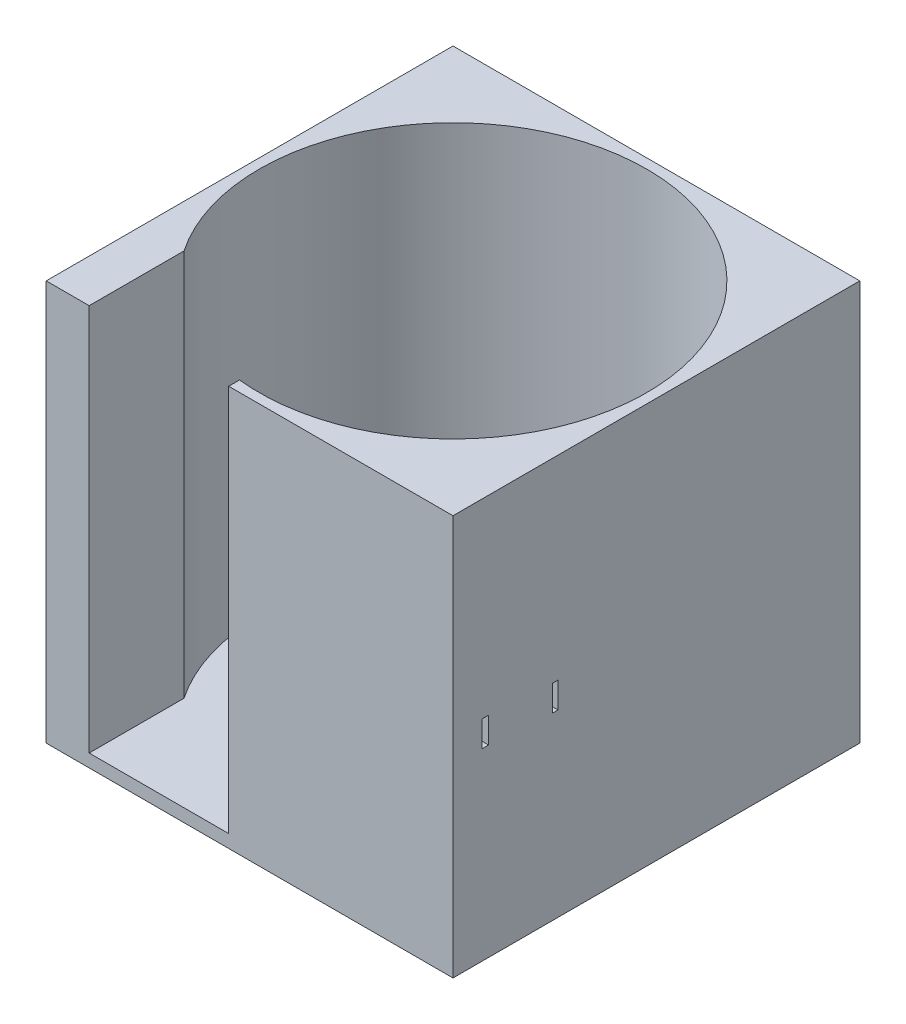
from build123d import *

# Parameters (mm, degrees)
SKETCH1_W           = 63
SKETCH1_H           = 63
BOSS_EXTRUDE1_DEPTH = 62
SKETCH2_R           = 30
CUT_EXTRUDE1_DEPTH  = 60
SKETCH4_R           = 5
CUT_EXTRUDE2_DEPTH  = 75.729512242
SKETCH17_W          = 21.612329741
SKETCH17_H          = 14.688965968
CUT_EXTRUDE10_DEPTH = 60
SKETCH9_W           = 0.725609756
SKETCH9_H           = 2.475609756
CUT_EXTRUDE5_DEPTH  = 0.5
CUT_EXTRUDE6_DEPTH  = 0.5
SKETCH7_W           = 0.725609756
SKETCH7_H           = 2.475609756
CUT_EXTRUDE7_DEPTH  = 0.5
SKETCH19_W          = 0.869800042
SKETCH19_H          = 4
CUT_EXTRUDE11_DEPTH = 10
SKETCH21_W          = 3
SKETCH21_H          = 3
CUT_EXTRUDE17_DEPTH = 27.5
SKETCH25_W          = 1
SKETCH25_H          = 4
CUT_EXTRUDE21_DEPTH = 5
SKETCH29_R          = 3.05
CUT_EXTRUDE25_DEPTH = 8.5
SKETCH30_R          = 2
CUT_EXTRUDE26_DEPTH = 32.5


with BuildPart() as part:
    # Sketch1 → Boss-Extrude1 (new body)
    with BuildSketch(Plane(origin=(0, 0, 0), x_dir=(1, 0, 0), z_dir=(0, 1, 0))):
        Rectangle(SKETCH1_W, SKETCH1_H)
    extrude(amount=BOSS_EXTRUDE1_DEPTH)

    # Sketch2 → Cut-Extrude1 (cut)
    with BuildSketch(Plane(origin=(0, 62, 0), x_dir=(1, 0, 0), z_dir=(0, 1, 0))):
        with Locations(Location((0, 0, 0), (0, 0, 270))):
            Circle(SKETCH2_R)
    extrude(amount=-CUT_EXTRUDE1_DEPTH, mode=Mode.SUBTRACT)

    # Sketch4 → Cut-Extrude2 (cut, through all)
    with BuildSketch(Plane(origin=(0, 2, 0), x_dir=(1, 0, 0), z_dir=(0, 1, 0))):
        with Locations(Location((0, 0, 0), (0, 0, 270))):
            Circle(SKETCH4_R)
    extrude(amount=-CUT_EXTRUDE2_DEPTH, mode=Mode.SUBTRACT)

    # Sketch17 → Cut-Extrude10 (cut)
    with BuildSketch(Plane(origin=(0, 62, 0), x_dir=(1, 0, 0), z_dir=(0, 1, 0))):
        with Locations((-14.04115158, -24.155517016)):
            Rectangle(SKETCH17_W, SKETCH17_H)
    extrude(amount=-CUT_EXTRUDE10_DEPTH, mode=Mode.SUBTRACT)

    # Sketch9 → Cut-Extrude5 (cut)
    # profile 1 of 8: a face of its own
    with BuildSketch(Plane(origin=(0, 2, 0), x_dir=(1, 0, 0), z_dir=(0, 1, 0))):
        with BuildLine():
            Line((8.476007562, -11.920939164), (8.476007562, -9.799464316))
            add(Edge.make_bspline(
                [(8.476007562, -9.799464316), (8.476028179, -9.774116527), (8.476070515, -9.722064729), (8.480084679, -9.641604836), (8.484428088, -9.556426682), (8.491180394, -9.466376694), (8.500149561, -9.371717232), (8.50968717, -9.272238775), (8.522848773, -9.168296878), (8.5320128, -9.097416383), (8.536697349, -9.061183066)],
                knots=[0, 0, 0, 0, 0.820532149, 1.684966374, 2.607606779, 3.581914253, 4.608215301, 5.686044516, 6.81713186, 8, 8, 8, 8], degree=3))
            Line((8.536697349, -9.061183066), (8.518690489, -9.061183066))
            add(Edge.make_bspline(
                [(8.518690489, -9.061183066), (8.513219792, -9.088100756), (8.502764026, -9.139546678), (8.486408273, -9.213008001), (8.472101378, -9.279611179), (8.457967988, -9.339166161), (8.444793062, -9.391907328), (8.431994909, -9.437608796), (8.421087015, -9.476508831), (8.41297425, -9.499604736), (8.409315489, -9.510020719)],
                knots=[0, 0, 0, 0, 1.426064356, 2.725538406, 3.907327566, 4.962762773, 5.903337351, 6.72936823, 7.426959974, 8, 8, 8, 8], degree=3))
            Line((8.409315489, -9.510020719), (7.536983172, -11.920939164))
            Line((7.536983172, -11.920939164), (6.939422196, -11.920939164))
            Line((6.939422196, -11.920939164), (6.0677568, -9.532696024))
            add(Edge.make_bspline(
                [(6.0677568, -9.532696024), (6.064787472, -9.524050993), (6.057839614, -9.503822697), (6.048138591, -9.468354387), (6.036925621, -9.423361206), (6.023430741, -9.369252788), (6.0097193, -9.305277969), (5.993847632, -9.232334376), (5.975329179, -9.150060219), (5.963800731, -9.091890684), (5.957714879, -9.061183066)],
                knots=[0, 0, 0, 0, 0.452786508, 1.059464042, 1.820794487, 2.75042866, 3.822030313, 5.062086147, 6.449079346, 8, 8, 8, 8], degree=3))
            Line((5.957714879, -9.061183066), (5.937707257, -9.061183066))
            add(Edge.make_bspline(
                [(5.937707257, -9.061183066), (5.94370949, -9.208107766), (5.955719736, -9.502098666), (5.957049618, -9.796331813), (5.957714879, -9.943519195)],
                knots=[0, 0, 0, 0, 0.999518694, 2, 2, 2, 2], degree=3))
            Line((5.957714879, -9.943519195), (5.957714879, -11.920939164))
            Line((5.957714879, -11.920939164), (5.27478805, -11.920939164))
            Line((5.27478805, -11.920939164), (5.27478805, -8.420939164))
            Line((5.27478805, -8.420939164), (6.384544147, -8.420939164))
            Line((6.384544147, -8.420939164), (7.132162288, -10.536411725))
            add(Edge.make_bspline(
                [(7.132162288, -10.536411725), (7.146980779, -10.579419885), (7.17589647, -10.663342777), (7.212160843, -10.788530406), (7.240500068, -10.909876865), (7.253738215, -10.990060157), (7.260211068, -11.029266146)],
                knots=[0, 0, 0, 0, 1.070175583, 2.088260221, 3.065246074, 4, 4, 4, 4], degree=3))
            Line((7.260211068, -11.029266146), (7.275550245, -11.029266146))
            add(Edge.make_bspline(
                [(7.275550245, -11.029266146), (7.287096951, -10.982963631), (7.309476465, -10.893221349), (7.345761456, -10.764170991), (7.38113638, -10.644179281), (7.407536811, -10.568331356), (7.420272044, -10.53174328)],
                knots=[0, 0, 0, 0, 1.1046679, 2.14103741, 3.103260037, 4, 4, 4, 4], degree=3))
            Line((7.420272044, -10.53174328), (8.177227074, -8.420939164))
            Line((8.177227074, -8.420939164), (9.201617318, -8.420939164))
            Line((9.201617318, -8.420939164), (9.201617318, -11.920939164))
            Line((9.201617318, -11.920939164), (8.476007562, -11.920939164))
        make_face()
    # profile 2 of 8: a face of its own
    with BuildSketch(Plane(origin=(0, 2, 0), x_dir=(1, 0, 0), z_dir=(0, 1, 0))):
        with BuildLine():
            add(Edge.make_bspline(
                [(9.799178294, -10.694471938), (9.80032199, -10.645511249), (9.802554504, -10.5499392), (9.820173182, -10.410854888), (9.848680848, -10.279667571), (9.889056322, -10.156446728), (9.942612841, -10.041776974), (10.005645787, -9.934175672), (10.08188179, -9.835438771), (10.169325916, -9.745767878), (10.266004995, -9.664937473), (10.37134124, -9.594575766), (10.484862612, -9.534858189), (10.606268735, -9.486311362), (10.735718109, -9.449018589), (10.87262387, -9.42161459), (11.017926483, -9.405576768), (11.117418192, -9.403638858), (11.168366556, -9.402646481)],
                knots=[0, 0, 0, 0, 1.103453058, 2.15395801, 3.154678934, 4.126148344, 5.070148626, 6.002678962, 6.931877209, 7.874599583, 8.821044363, 9.767595283, 10.724805658, 11.707533345, 12.709834137, 13.757538153, 14.851665509, 16, 16, 16, 16], degree=3))
            add(Edge.make_bspline(
                [(11.168366556, -9.402646481), (11.21776967, -9.403591628), (11.314179153, -9.405436068), (11.454614769, -9.422091461), (11.587466749, -9.447260759), (11.712021838, -9.485285217), (11.829607784, -9.532097967), (11.938566014, -9.591406028), (12.040151974, -9.660244223), (12.132605312, -9.739796121), (12.216338278, -9.827786843), (12.289086741, -9.924088857), (12.351067773, -10.027507705), (12.401230186, -10.138601393), (12.440574886, -10.256824988), (12.468440233, -10.382401567), (12.485473264, -10.515043375), (12.487278769, -10.605941492), (12.488202684, -10.652455932)],
                knots=[0, 0, 0, 0, 1.154217571, 2.252439331, 3.300975582, 4.310246632, 5.291497618, 6.253956641, 7.203666926, 8.154399993, 9.098965462, 10.037337181, 10.969401587, 11.911118977, 12.880523217, 13.876343809, 14.913281367, 16, 16, 16, 16], degree=3))
            add(Edge.make_bspline(
                [(12.488202684, -10.652455932), (12.48697369, -10.701184929), (12.484570023, -10.796489131), (12.468039237, -10.935666592), (12.439275045, -11.067181295), (12.399179384, -11.191201308), (12.347987247, -11.308039031), (12.284030192, -11.416356428), (12.209544476, -11.517529355), (12.123466226, -11.609700172), (12.028348992, -11.693254265), (11.924015151, -11.765795627), (11.811728705, -11.827130442), (11.691334632, -11.877651083), (11.56285635, -11.915844211), (11.426587221, -11.944018132), (11.282168041, -11.960867424), (11.183084233, -11.962689288), (11.132352836, -11.963622091)],
                knots=[0, 0, 0, 0, 1.09727435, 2.146049842, 3.15059286, 4.124223328, 5.076775921, 6.016934818, 6.951103508, 7.900454057, 8.851281785, 9.797022045, 10.755907445, 11.727489397, 12.731570765, 13.76934414, 14.857893218, 16, 16, 16, 16], degree=3))
            add(Edge.make_bspline(
                [(11.132352836, -11.963622091), (11.082510802, -11.962652216), (10.985225776, -11.960759148), (10.843345435, -11.944433582), (10.709383923, -11.91805604), (10.583185778, -11.880597998), (10.464982237, -11.832654578), (10.35432477, -11.774275792), (10.251966624, -11.704602965), (10.157938427, -11.624463728), (10.073241437, -11.53556066), (9.999970305, -11.437765646), (9.937691379, -11.332718097), (9.886696944, -11.219780253), (9.847363416, -11.099200516), (9.819767979, -10.970904876), (9.801687626, -10.835262563), (9.80002728, -10.742105868), (9.799178294, -10.694471938)],
                knots=[0, 0, 0, 0, 1.149013187, 2.242721024, 3.288275975, 4.293858527, 5.273402544, 6.22507903, 7.173436187, 8.122568892, 9.068984397, 9.998887601, 10.934313246, 11.879547946, 12.850577541, 13.85308481, 14.902215176, 16, 16, 16, 16], degree=3))
        make_face()
        with BuildLine():
            add(Edge.make_bspline(
                [(10.52478805, -10.685135048), (10.525311334, -10.714275091), (10.526327676, -10.77087203), (10.533843841, -10.853055149), (10.545332156, -10.92987072), (10.562818888, -11.000751235), (10.584610398, -11.066152587), (10.61220813, -11.125669861), (10.64397502, -11.180221242), (10.681609115, -11.228486092), (10.724076759, -11.270886434), (10.771208194, -11.307988054), (10.823377309, -11.339426849), (10.880650952, -11.36463509), (10.942442603, -11.384998909), (11.009401022, -11.398432972), (11.081192758, -11.407563111), (11.130765578, -11.408341915), (11.156361983, -11.408744042)],
                knots=[0, 0, 0, 0, 1.270888468, 2.468369665, 3.597092737, 4.655434961, 5.64897887, 6.599178008, 7.512182997, 8.396678124, 9.260629555, 10.123873252, 11.006932034, 11.909787606, 12.848136796, 13.838979758, 14.884179917, 16, 16, 16, 16], degree=3))
            add(Edge.make_bspline(
                [(11.156361983, -11.408744042), (11.18084315, -11.408314533), (11.228414193, -11.407479926), (11.297436569, -11.398655547), (11.361860213, -11.384162974), (11.421341236, -11.363491348), (11.476234546, -11.337200857), (11.526262369, -11.305275023), (11.571842537, -11.267247772), (11.612116237, -11.223323422), (11.648237824, -11.173827253), (11.678718066, -11.118097402), (11.70459734, -11.056574782), (11.725874648, -10.989583913), (11.742546014, -10.916877497), (11.754460327, -10.838421691), (11.760815681, -10.753932338), (11.761987569, -10.695815556), (11.762592928, -10.665794347)],
                knots=[0, 0, 0, 0, 1.070965572, 2.081066958, 3.039323393, 3.956285232, 4.830977526, 5.697350879, 6.546953418, 7.421375102, 8.299092527, 9.222381685, 10.194613687, 11.216177451, 12.294761889, 13.456137845, 14.68592486, 16, 16, 16, 16], degree=3))
            add(Edge.make_bspline(
                [(11.762592928, -10.665794347), (11.761986474, -10.637106944), (11.760814193, -10.58165395), (11.754497821, -10.50114656), (11.742408109, -10.426270747), (11.725943073, -10.356857075), (11.704791195, -10.292771625), (11.677769208, -10.234759825), (11.647265336, -10.181303754), (11.611142272, -10.133793432), (11.569966851, -10.092105817), (11.524510753, -10.055654571), (11.473658752, -10.025784013), (11.418776362, -9.999927626), (11.358620808, -9.980862573), (11.293732512, -9.967885965), (11.224425005, -9.958704572), (11.176401743, -9.957925412), (11.151693538, -9.95752453)],
                knots=[0, 0, 0, 0, 1.285280532, 2.484458215, 3.614137234, 4.679338145, 5.677637889, 6.631225331, 7.541609585, 8.429939353, 9.296111078, 10.160850403, 11.031874669, 11.931905529, 12.873562193, 13.850117319, 14.893874718, 16, 16, 16, 16], degree=3))
            add(Edge.make_bspline(
                [(11.151693538, -9.95752453), (11.127646706, -9.957880554), (11.080691759, -9.958575742), (11.012455017, -9.968540861), (10.948017899, -9.982851298), (10.887726605, -10.003435896), (10.831728892, -10.03060992), (10.77951275, -10.063076326), (10.731799394, -10.102314763), (10.688429435, -10.14707842), (10.6496702, -10.197156648), (10.616195864, -10.252534634), (10.587301193, -10.312439848), (10.564981589, -10.37776818), (10.546938239, -10.44754789), (10.533447026, -10.522179147), (10.526437844, -10.602079066), (10.525349102, -10.656889865), (10.52478805, -10.685135048)],
                knots=[0, 0, 0, 0, 1.057503077, 2.064929068, 3.028638446, 3.96006429, 4.861611523, 5.762946329, 6.660021997, 7.573438799, 8.50115664, 9.440922936, 10.416923198, 11.42268461, 12.474058499, 13.587313027, 14.756690526, 16, 16, 16, 16], degree=3))
        make_face(mode=Mode.SUBTRACT)
    # profile 3 of 8: a face of its own
    with BuildSketch(Plane(origin=(0, 2, 0), x_dir=(1, 0, 0), z_dir=(0, 1, 0))):
        with BuildLine():
            add(Edge.make_bspline(
                [(14.579666099, -10.128256237), (14.556928731, -10.114995133), (14.510753432, -10.088064335), (14.432831971, -10.062219385), (14.348733405, -10.045649989), (14.290308555, -10.043828646), (14.260211068, -10.042890384)],
                knots=[0, 0, 0, 0, 0.940441105, 1.909858304, 2.923266192, 4, 4, 4, 4], degree=3))
            add(Edge.make_bspline(
                [(14.260211068, -10.042890384), (14.240170929, -10.043328112), (14.201002796, -10.044183645), (14.143926371, -10.053054655), (14.089983663, -10.06778939), (14.039380495, -10.088403339), (13.991887145, -10.114818665), (13.94769954, -10.147204037), (13.906068112, -10.185065015), (13.869192793, -10.229653114), (13.834600489, -10.277891837), (13.806610629, -10.332096058), (13.780574198, -10.38911324), (13.761101167, -10.451303904), (13.744519054, -10.517325315), (13.734902422, -10.588242025), (13.726601764, -10.663157198), (13.7262093, -10.714674733), (13.726007562, -10.74115639)],
                knots=[0, 0, 0, 0, 0.970686144, 1.897190647, 2.79117155, 3.675555974, 4.538950212, 5.418266111, 6.325716291, 7.258340523, 8.217839255, 9.196446581, 10.209503726, 11.252153644, 12.349752687, 13.504815547, 14.717395568, 16, 16, 16, 16], degree=3))
            Line((13.726007562, -10.74115639), (13.726007562, -11.920939164))
            Line((13.726007562, -11.920939164), (13.000397806, -11.920939164))
            Line((13.000397806, -11.920939164), (13.000397806, -9.445329408))
            Line((13.000397806, -9.445329408), (13.726007562, -9.445329408))
            Line((13.726007562, -9.445329408), (13.726007562, -9.928180018))
            Line((13.726007562, -9.928180018), (13.734677531, -9.928180018))
            add(Edge.make_bspline(
                [(13.734677531, -9.928180018), (13.750154211, -9.886640366), (13.779777202, -9.807131788), (13.837997513, -9.698899325), (13.906601362, -9.607800687), (13.983781195, -9.532381162), (14.070927962, -9.473637079), (14.167479378, -9.432193621), (14.273352617, -9.406666329), (14.346985228, -9.404013421), (14.384925245, -9.402646481)],
                knots=[0, 0, 0, 0, 1.179674643, 2.25794511, 3.259707241, 4.205994462, 5.118987459, 6.041775795, 6.991003325, 8, 8, 8, 8], degree=3))
            add(Edge.make_bspline(
                [(14.384925245, -9.402646481), (14.404948721, -9.403040754), (14.442628443, -9.403782687), (14.495291572, -9.408890657), (14.540784361, -9.417506751), (14.567326849, -9.427849642), (14.579666099, -9.432657914)],
                knots=[0, 0, 0, 0, 1.211304354, 2.27940499, 3.200118309, 4, 4, 4, 4], degree=3))
            Line((14.579666099, -9.432657914), (14.579666099, -10.128256237))
        make_face()
    # profile 4 of 8: a face of its own
    with BuildSketch(Plane(origin=(0, 2, 0), x_dir=(1, 0, 0), z_dir=(0, 1, 0))):
        with BuildLine():
            Line((17.311373416, -11.920939164), (16.58576366, -11.920939164))
            Line((16.58576366, -11.920939164), (16.58576366, -10.552417823))
            add(Edge.make_bspline(
                [(16.58576366, -10.552417823), (16.585665364, -10.528392967), (16.585474873, -10.481833917), (16.579529815, -10.414455373), (16.572287471, -10.351478349), (16.559812625, -10.293488911), (16.545606491, -10.239488623), (16.526878204, -10.190512925), (16.50554072, -10.145936063), (16.480928972, -10.105956079), (16.451741154, -10.071450306), (16.420708011, -10.040199155), (16.385419879, -10.014673348), (16.346781382, -9.993862575), (16.305037671, -9.977029049), (16.259613584, -9.966144358), (16.211455905, -9.958190487), (16.178088757, -9.957750646), (16.160935153, -9.95752453)],
                knots=[0, 0, 0, 0, 1.385577933, 2.685185481, 3.900730131, 5.040333697, 6.104607026, 7.119499225, 8.0603568, 8.953669725, 9.819198624, 10.662777709, 11.488914802, 12.321203114, 13.190620345, 14.077277699, 15.011554236, 16, 16, 16, 16], degree=3))
            add(Edge.make_bspline(
                [(16.160935153, -9.95752453), (16.14445649, -9.95807661), (16.111782138, -9.959171288), (16.063954044, -9.966670194), (16.018146623, -9.978418616), (15.974810432, -9.996233463), (15.933546942, -10.018997187), (15.894061027, -10.046319992), (15.857015906, -10.078824733), (15.822571481, -10.115910563), (15.791768524, -10.157081811), (15.763666545, -10.20057892), (15.741496594, -10.247781971), (15.721747941, -10.296991448), (15.707060423, -10.349319123), (15.697574256, -10.404333093), (15.690267101, -10.461746927), (15.689707496, -10.501039988), (15.689422196, -10.521072548)],
                knots=[0, 0, 0, 0, 0.962967614, 1.90939895, 2.82343066, 3.721059163, 4.639881235, 5.573469571, 6.522039335, 7.515047549, 8.526002385, 9.52460601, 10.535811341, 11.568577159, 12.621661098, 13.704858409, 14.829880903, 16, 16, 16, 16], degree=3))
            Line((15.689422196, -10.521072548), (15.689422196, -11.920939164))
            Line((15.689422196, -11.920939164), (14.96381244, -11.920939164))
            Line((14.96381244, -11.920939164), (14.96381244, -9.445329408))
            Line((14.96381244, -9.445329408), (15.689422196, -9.445329408))
            Line((15.689422196, -9.445329408), (15.689422196, -9.856152579))
            Line((15.689422196, -9.856152579), (15.698092166, -9.856152579))
            add(Edge.make_bspline(
                [(15.698092166, -9.856152579), (15.721062268, -9.820229941), (15.765963358, -9.750009726), (15.845571526, -9.656676235), (15.934188327, -9.578504457), (16.029970968, -9.513447317), (16.134658126, -9.464289557), (16.246412865, -9.427350327), (16.366724971, -9.407066071), (16.449418963, -9.40414235), (16.491727836, -9.402646481)],
                knots=[0, 0, 0, 0, 1.064617132, 2.081073364, 3.053068974, 4.009833717, 4.963950105, 5.933641332, 6.942785272, 8, 8, 8, 8], degree=3))
            add(Edge.make_bspline(
                [(16.491727836, -9.402646481), (16.524896986, -9.4033349), (16.58924227, -9.404670372), (16.682465502, -9.417262485), (16.769715374, -9.435789148), (16.850032386, -9.464277216), (16.924528722, -9.499540131), (16.991956605, -9.543903222), (17.053386825, -9.595785881), (17.1083896, -9.655512887), (17.156690146, -9.723451989), (17.197750729, -9.799422054), (17.233616542, -9.882734486), (17.261593614, -9.974355972), (17.28458603, -10.073681496), (17.300111102, -10.180979334), (17.309449795, -10.296153185), (17.310718572, -10.375442874), (17.311373416, -10.416365993)],
                knots=[0, 0, 0, 0, 1.067420533, 2.070703575, 3.024128503, 3.934192378, 4.808213066, 5.671854353, 6.525140104, 7.391387901, 8.279251406, 9.20186848, 10.167150257, 11.194978914, 12.281972813, 13.447160288, 14.682424336, 16, 16, 16, 16], degree=3))
            Line((17.311373416, -10.416365993), (17.311373416, -11.920939164))
        make_face()
    # profile 5 of 8: a face of its own
    with BuildSketch(Plane(origin=(0, 2, 0), x_dir=(1, 0, 0), z_dir=(0, 1, 0))):
        with BuildLine():
            add(Edge.make_bspline(
                [(17.866251464, -8.631019195), (17.867481413, -8.60393771), (17.869867217, -8.551406171), (17.893626778, -8.476945988), (17.931707069, -8.41059797), (17.984596621, -8.353925033), (18.048177283, -8.307089163), (18.122194508, -8.274259012), (18.204147666, -8.253570925), (18.261826519, -8.251356282), (18.291746891, -8.250207457)],
                knots=[0, 0, 0, 0, 1.013028915, 1.965031382, 2.898897403, 3.860779748, 4.851395127, 5.840219378, 6.879633759, 8, 8, 8, 8], degree=3))
            add(Edge.make_bspline(
                [(18.291746891, -8.250207457), (18.322338907, -8.251300222), (18.381180483, -8.25340208), (18.46462643, -8.274720118), (18.538989444, -8.308880792), (18.602365464, -8.356804798), (18.654921785, -8.413864732), (18.693092398, -8.47979794), (18.716060357, -8.553279146), (18.718602746, -8.604620363), (18.719910001, -8.631019195)],
                knots=[0, 0, 0, 0, 1.142627177, 2.19776242, 3.198786164, 4.185327788, 5.151100774, 6.082777914, 7.014195085, 8, 8, 8, 8], degree=3))
            add(Edge.make_bspline(
                [(18.719910001, -8.631019195), (18.718640918, -8.657650084), (18.716159328, -8.709724656), (18.692375262, -8.784243509), (18.653609639, -8.85148428), (18.600321893, -8.910025232), (18.536258671, -8.959000729), (18.461553804, -8.992857072), (18.379550012, -9.015527295), (18.321699116, -9.017486015), (18.291746891, -9.01850014)],
                knots=[0, 0, 0, 0, 0.988219534, 1.93238422, 2.877019531, 3.854909869, 4.858781534, 5.853896348, 6.888857669, 8, 8, 8, 8], degree=3))
            add(Edge.make_bspline(
                [(18.291746891, -9.01850014), (18.262244292, -9.017460425), (18.205063217, -9.015445281), (18.123587137, -8.992868589), (18.049503105, -8.958373399), (17.985529847, -8.90917072), (17.932730524, -8.850203759), (17.893917911, -8.783103479), (17.869984617, -8.709077075), (17.86751463, -8.657431187), (17.866251464, -8.631019195)],
                knots=[0, 0, 0, 0, 1.099806221, 2.131612243, 3.134962962, 4.136936871, 5.125630748, 6.074715084, 7.015398662, 8, 8, 8, 8], degree=3))
        make_face()
    # profile 6 of 8: a face of its own
    with BuildSketch(Plane(origin=(0, 2, 0), x_dir=(1, 0, 0), z_dir=(0, 1, 0))):
        with Locations((18.271739269, -10.683134286)):
            Rectangle(SKETCH9_W, SKETCH9_H)
    # profile 7 of 8: a face of its own
    with BuildSketch(Plane(origin=(0, 2, 0), x_dir=(1, 0, 0), z_dir=(0, 1, 0))):
        with BuildLine():
            Line((21.665031952, -11.920939164), (20.939422196, -11.920939164))
            Line((20.939422196, -11.920939164), (20.939422196, -10.552417823))
            add(Edge.make_bspline(
                [(20.939422196, -10.552417823), (20.939323901, -10.528392967), (20.939133409, -10.481833917), (20.933188352, -10.414455373), (20.925946008, -10.351478349), (20.913471162, -10.293488911), (20.899265028, -10.239488623), (20.88053674, -10.190512925), (20.859199257, -10.145936063), (20.834587508, -10.105956079), (20.805399691, -10.071450306), (20.774366548, -10.040199155), (20.739078416, -10.014673348), (20.700439919, -9.993862575), (20.658696208, -9.977029049), (20.61327212, -9.966144358), (20.565114442, -9.958190487), (20.531747294, -9.957750646), (20.51459369, -9.95752453)],
                knots=[0, 0, 0, 0, 1.385577933, 2.685185481, 3.900730131, 5.040333697, 6.104607026, 7.119499225, 8.0603568, 8.953669725, 9.819198624, 10.662777709, 11.488914802, 12.321203114, 13.190620345, 14.077277699, 15.011554236, 16, 16, 16, 16], degree=3))
            add(Edge.make_bspline(
                [(20.51459369, -9.95752453), (20.498115027, -9.95807661), (20.465440675, -9.959171288), (20.417612581, -9.966670194), (20.37180516, -9.978418616), (20.328468969, -9.996233463), (20.287205479, -10.018997187), (20.247719564, -10.046319992), (20.210674442, -10.078824733), (20.176230017, -10.115910563), (20.14542706, -10.157081811), (20.117325081, -10.20057892), (20.095155131, -10.247781971), (20.075406478, -10.296991448), (20.060718959, -10.349319123), (20.051232792, -10.404333093), (20.043925637, -10.461746927), (20.043366033, -10.501039988), (20.043080733, -10.521072548)],
                knots=[0, 0, 0, 0, 0.962967614, 1.90939895, 2.82343066, 3.721059163, 4.639881235, 5.573469571, 6.522039335, 7.515047549, 8.526002385, 9.52460601, 10.535811341, 11.568577159, 12.621661098, 13.704858409, 14.829880903, 16, 16, 16, 16], degree=3))
            Line((20.043080733, -10.521072548), (20.043080733, -11.920939164))
            Line((20.043080733, -11.920939164), (19.317470977, -11.920939164))
            Line((19.317470977, -11.920939164), (19.317470977, -9.445329408))
            Line((19.317470977, -9.445329408), (20.043080733, -9.445329408))
            Line((20.043080733, -9.445329408), (20.043080733, -9.856152579))
            Line((20.043080733, -9.856152579), (20.051750702, -9.856152579))
            add(Edge.make_bspline(
                [(20.051750702, -9.856152579), (20.074720805, -9.820229941), (20.119621895, -9.750009726), (20.199230062, -9.656676235), (20.287846864, -9.578504457), (20.383629504, -9.513447317), (20.488316663, -9.464289557), (20.600071402, -9.427350327), (20.720383508, -9.407066071), (20.8030775, -9.40414235), (20.845386373, -9.402646481)],
                knots=[0, 0, 0, 0, 1.064617132, 2.081073364, 3.053068974, 4.009833717, 4.963950105, 5.933641332, 6.942785272, 8, 8, 8, 8], degree=3))
            add(Edge.make_bspline(
                [(20.845386373, -9.402646481), (20.878555523, -9.4033349), (20.942900807, -9.404670372), (21.036124038, -9.417262485), (21.123373911, -9.435789148), (21.203690923, -9.464277216), (21.278187259, -9.499540131), (21.345615141, -9.543903222), (21.407045361, -9.595785881), (21.462048137, -9.655512887), (21.510348683, -9.723451989), (21.551409266, -9.799422054), (21.587275078, -9.882734486), (21.615252151, -9.974355972), (21.638244566, -10.073681496), (21.653769638, -10.180979334), (21.663108331, -10.296153185), (21.664377109, -10.375442874), (21.665031952, -10.416365993)],
                knots=[0, 0, 0, 0, 1.067420533, 2.070703575, 3.024128503, 3.934192378, 4.808213066, 5.671854353, 6.525140104, 7.391387901, 8.279251406, 9.20186848, 10.167150257, 11.194978914, 12.281972813, 13.447160288, 14.682424336, 16, 16, 16, 16], degree=3))
            Line((21.665031952, -10.416365993), (21.665031952, -11.920939164))
        make_face()
    # profile 8 of 8: a face of its own
    with BuildSketch(Plane(origin=(0, 2, 0), x_dir=(1, 0, 0), z_dir=(0, 1, 0))):
        with BuildLine():
            add(Edge.make_bspline(
                [(24.695519757, -11.668176207), (24.694468884, -11.724472114), (24.692419131, -11.834278609), (24.673577967, -11.99389192), (24.642316335, -12.14344871), (24.599052697, -12.28326156), (24.543088203, -12.413053532), (24.474435893, -12.532987084), (24.393622549, -12.643047711), (24.299542229, -12.741989451), (24.194406012, -12.830348418), (24.07826776, -12.907660277), (23.950775378, -12.972345824), (23.812290609, -13.025010565), (23.663147393, -13.066286194), (23.502891067, -13.095316546), (23.331828727, -13.112673446), (23.214108162, -13.114910999), (23.153599025, -13.116061115)],
                knots=[0, 0, 0, 0, 1.12065638, 2.1858667, 3.19470124, 4.159360294, 5.095180088, 6.003327766, 6.905511298, 7.807336379, 8.715322212, 9.634898705, 10.57923347, 11.5558841, 12.580474579, 13.656228711, 14.795286309, 16, 16, 16, 16], degree=3))
            add(Edge.make_bspline(
                [(23.153599025, -13.116061115), (23.112458778, -13.115824746), (23.032330403, -13.115364374), (22.915323058, -13.107522066), (22.804748797, -13.096348739), (22.700392215, -13.081578266), (22.602983668, -13.060605285), (22.511814417, -13.036058352), (22.426833177, -13.007267063), (22.37379321, -12.983107049), (22.347958781, -12.971339316)],
                knots=[0, 0, 0, 0, 1.196444822, 2.330301501, 3.409341297, 4.429007637, 5.394151834, 6.30554997, 7.174676154, 8, 8, 8, 8], degree=3))
            Line((22.347958781, -12.971339316), (22.347958781, -12.347768432))
            add(Edge.make_bspline(
                [(22.347958781, -12.347768432), (22.380214724, -12.36485005), (22.444056962, -12.398658664), (22.542244277, -12.441679295), (22.640554063, -12.478749143), (22.739080596, -12.508573467), (22.837692412, -12.532276438), (22.936410541, -12.548800919), (23.035549513, -12.559276755), (23.101775863, -12.560547166), (23.134925245, -12.561183066)],
                knots=[0, 0, 0, 0, 1.062757299, 2.103451342, 3.119687654, 4.121276583, 5.099680627, 6.071528297, 7.034709803, 8, 8, 8, 8], degree=3))
            add(Edge.make_bspline(
                [(23.134925245, -12.561183066), (23.166741993, -12.5605758), (23.228761918, -12.559392063), (23.319115094, -12.549243202), (23.404341055, -12.532588002), (23.484260351, -12.509701701), (23.558547297, -12.479177881), (23.627539898, -12.442567452), (23.69130887, -12.398958887), (23.749401263, -12.348795715), (23.801610381, -12.292891589), (23.846552972, -12.230909041), (23.884528538, -12.163927653), (23.916298767, -12.092126885), (23.940093459, -12.01482152), (23.95726629, -11.932440846), (23.968284121, -11.84498497), (23.969359919, -11.784921135), (23.969910001, -11.754208981)],
                knots=[0, 0, 0, 0, 1.15881316, 2.258857661, 3.307123238, 4.319453179, 5.2819655, 6.227600883, 7.1598243, 8.09007565, 9.018421396, 9.940137662, 10.872325901, 11.818793222, 12.794704488, 13.812848753, 14.881654413, 16, 16, 16, 16], degree=3))
            Line((23.969910001, -11.754208981), (23.969910001, -11.541461268))
            Line((23.969910001, -11.541461268), (23.958572349, -11.541461268))
            add(Edge.make_bspline(
                [(23.958572349, -11.541461268), (23.936035705, -11.574971596), (23.891870075, -11.640642634), (23.813040602, -11.727153827), (23.72643479, -11.800714935), (23.631327087, -11.860843717), (23.527896204, -11.906931559), (23.416407691, -11.939544813), (23.297296493, -11.960058219), (23.215041082, -11.962415531), (23.172939727, -11.963622091)],
                knots=[0, 0, 0, 0, 1.035535847, 2.029365776, 2.993119022, 3.944630181, 4.907622856, 5.889851003, 6.919947867, 8, 8, 8, 8], degree=3))
            add(Edge.make_bspline(
                [(23.172939727, -11.963622091), (23.134647959, -11.96259563), (23.059527947, -11.960581938), (22.949851974, -11.944832563), (22.845895993, -11.919992658), (22.747990822, -11.883347602), (22.65613555, -11.836700798), (22.569694442, -11.780277983), (22.489866906, -11.712788958), (22.416438512, -11.635624716), (22.349450526, -11.550477413), (22.291958075, -11.456979008), (22.24331317, -11.356576753), (22.20307721, -11.249486322), (22.172543792, -11.135283907), (22.150813017, -11.0143742), (22.137183349, -10.886410274), (22.135438748, -10.798768875), (22.134544147, -10.753827884)],
                knots=[0, 0, 0, 0, 1.022714219, 2.006340019, 2.954240055, 3.873265925, 4.792349374, 5.701708431, 6.624947227, 7.57856158, 8.543338515, 9.514184723, 10.505028973, 11.519986852, 12.56602973, 13.658817762, 14.799482292, 16, 16, 16, 16], degree=3))
            add(Edge.make_bspline(
                [(22.134544147, -10.753827884), (22.135355334, -10.703772796), (22.136941741, -10.605881989), (22.151802986, -10.462933588), (22.176424806, -10.327833005), (22.210149202, -10.200461261), (22.25436423, -10.08097913), (22.308450481, -9.969317125), (22.372176845, -9.865093138), (22.445199568, -9.769376962), (22.526444159, -9.683398587), (22.614230403, -9.608183587), (22.707940837, -9.544151302), (22.808363463, -9.492816242), (22.914298934, -9.451442191), (23.026771917, -9.423119468), (23.145304193, -9.406215048), (23.226236687, -9.403854274), (23.267642471, -9.402646481)],
                knots=[0, 0, 0, 0, 1.210931724, 2.36817253, 3.472872422, 4.531122129, 5.552342466, 6.550781788, 7.528723106, 8.503493179, 9.45860586, 10.385738438, 11.295860855, 12.198079774, 13.109155531, 14.042013317, 14.998276591, 16, 16, 16, 16], degree=3))
            add(Edge.make_bspline(
                [(23.267642471, -9.402646481), (23.304831255, -9.403571796), (23.377381871, -9.405376967), (23.482661397, -9.422300928), (23.580716565, -9.450357835), (23.671796126, -9.489056705), (23.755092989, -9.539649439), (23.831231227, -9.600943877), (23.900142, -9.673672038), (23.938813225, -9.729118071), (23.958572349, -9.75744831)],
                knots=[0, 0, 0, 0, 1.097430489, 2.140948141, 3.138144563, 4.102593131, 5.053817126, 6.006150182, 6.981239272, 8, 8, 8, 8], degree=3))
            Line((23.958572349, -9.75744831), (23.969910001, -9.75744831))
            Line((23.969910001, -9.75744831), (23.969910001, -9.445329408))
            Line((23.969910001, -9.445329408), (24.695519757, -9.445329408))
            Line((24.695519757, -9.445329408), (24.695519757, -11.668176207))
        make_face()
        with BuildLine():
            add(Edge.make_bspline(
                [(23.976579208, -10.527741755), (23.97595213, -10.508165721), (23.974715803, -10.469570248), (23.968371319, -10.412759896), (23.956044247, -10.358369152), (23.939528514, -10.30627058), (23.918046885, -10.256694332), (23.891890733, -10.209399738), (23.860140465, -10.165049834), (23.825400008, -10.122222193), (23.78598459, -10.084163832), (23.744943147, -10.049472524), (23.700175854, -10.021531957), (23.653625637, -9.997955383), (23.604303671, -9.980019384), (23.552845194, -9.966268682), (23.498369997, -9.959220213), (23.461288699, -9.958097275), (23.442375702, -9.95752453)],
                knots=[0, 0, 0, 0, 1.077575073, 2.124511933, 3.139518024, 4.141466922, 5.127685897, 6.107893374, 7.109020543, 8.125499792, 9.137553132, 10.119590778, 11.076547698, 12.033895451, 12.9859927, 13.959152642, 14.959083364, 16, 16, 16, 16], degree=3))
            add(Edge.make_bspline(
                [(23.442375702, -9.95752453), (23.420558859, -9.958200842), (23.377832198, -9.959525349), (23.315347799, -9.968863212), (23.25636328, -9.985039111), (23.200768646, -10.00696141), (23.148711748, -10.035279877), (23.100383776, -10.070315293), (23.05567601, -10.111802621), (23.01487624, -10.159543399), (22.978233054, -10.212646681), (22.947014036, -10.271536215), (22.919220946, -10.334552008), (22.898508609, -10.403513962), (22.88070318, -10.476868801), (22.869225529, -10.555908845), (22.861714236, -10.639861065), (22.860682733, -10.697566663), (22.860153903, -10.727151054)],
                knots=[0, 0, 0, 0, 0.961799932, 1.883613439, 2.777651096, 3.653120886, 4.512811163, 5.383328851, 6.278064702, 7.195542943, 8.147099986, 9.11631284, 10.130475854, 11.178277954, 12.286155092, 13.456115329, 14.695806251, 16, 16, 16, 16], degree=3))
            add(Edge.make_bspline(
                [(22.860153903, -10.727151054), (22.860762685, -10.752949957), (22.861945572, -10.803078278), (22.86832595, -10.876260262), (22.880405364, -10.94514463), (22.897109821, -11.009742004), (22.917528538, -11.070519073), (22.943794259, -11.126683377), (22.974545356, -11.178990468), (23.009684719, -11.22697834), (23.048982484, -11.269545622), (23.091414276, -11.306746223), (23.137072131, -11.338283897), (23.185788915, -11.36436675), (23.237698692, -11.384700985), (23.292658642, -11.398298599), (23.350475163, -11.407518029), (23.390095827, -11.408329129), (23.410363507, -11.408744042)],
                knots=[0, 0, 0, 0, 1.255250525, 2.439003023, 3.569798463, 4.653105148, 5.682548468, 6.684120248, 7.663432754, 8.630305417, 9.571681192, 10.476115834, 11.370079947, 12.265155427, 13.158857841, 14.074282215, 15.014912247, 16, 16, 16, 16], degree=3))
            add(Edge.make_bspline(
                [(23.410363507, -11.408744042), (23.430846641, -11.408296164), (23.471116278, -11.407415639), (23.529957155, -11.398572672), (23.585892775, -11.383864908), (23.63865395, -11.363131085), (23.688396566, -11.336771675), (23.735764902, -11.305319792), (23.779491906, -11.26707908), (23.820165023, -11.223750832), (23.856864258, -11.175733088), (23.888754262, -11.123539185), (23.916390573, -11.068108091), (23.938185857, -11.008963514), (23.955791079, -10.946813273), (23.967496446, -10.880896322), (23.974992, -10.811578338), (23.976042773, -10.764074158), (23.976579208, -10.739822548)],
                knots=[0, 0, 0, 0, 0.999119273, 1.964258558, 2.895884401, 3.816643394, 4.724203396, 5.638998155, 6.585167819, 7.552317495, 8.53534244, 9.529027182, 10.533434392, 11.553136989, 12.600853604, 13.681914839, 14.81658208, 16, 16, 16, 16], degree=3))
            Line((23.976579208, -10.739822548), (23.976579208, -10.527741755))
        make_face(mode=Mode.SUBTRACT)
    extrude(amount=-CUT_EXTRUDE5_DEPTH, mode=Mode.SUBTRACT)

    # Sketch8 → Cut-Extrude6 (cut)
    # profile 1 of 4: a face of its own
    with BuildSketch(Plane(origin=(0, 2, 0), x_dir=(1, 0, 0), z_dir=(0, 1, 0))):
        with BuildLine():
            Line((11.097961225, 7.903626332), (10.333003146, 7.903626332))
            Line((10.333003146, 7.903626332), (8.848437597, 10.167822216))
            add(Edge.make_bspline(
                [(8.848437597, 10.167822216), (8.830218305, 10.195701096), (8.795957831, 10.248125945), (8.750871397, 10.323943389), (8.712073381, 10.390353076), (8.690846838, 10.432928268), (8.681040494, 10.452597369)],
                knots=[0, 0, 0, 0, 1.208921234, 2.273316319, 3.202298026, 4, 4, 4, 4], degree=3))
            Line((8.681040494, 10.452597369), (8.669702841, 10.452597369))
            add(Edge.make_bspline(
                [(8.669702841, 10.452597369), (8.672696776, 10.436609149), (8.679081952, 10.402511005), (8.686962831, 10.348020291), (8.693539126, 10.287288899), (8.698786876, 10.220565949), (8.702777119, 10.147850258), (8.705162766, 10.068905284), (8.707422912, 9.983764416), (8.707616997, 9.924842557), (8.707717323, 9.894384716)],
                knots=[0, 0, 0, 0, 0.696655531, 1.485760197, 2.357460885, 3.312683909, 4.352132316, 5.476351145, 6.695477409, 8, 8, 8, 8], degree=3))
            Line((8.707717323, 9.894384716), (8.707717323, 7.903626332))
            Line((8.707717323, 7.903626332), (7.982107567, 7.903626332))
            Line((7.982107567, 7.903626332), (7.982107567, 11.403626332))
            Line((7.982107567, 11.403626332), (8.79641778, 11.403626332))
            Line((8.79641778, 11.403626332), (10.22696275, 9.202787918))
            add(Edge.make_bspline(
                [(10.22696275, 9.202787918), (10.238298646, 9.185447141), (10.259925041, 9.152364754), (10.290759036, 9.105252116), (10.31719372, 9.06249549), (10.34052393, 9.025142218), (10.360804909, 8.993073878), (10.377149647, 8.965756572), (10.390960538, 8.943922407), (10.397984212, 8.930500524), (10.401029061, 8.924681972)],
                knots=[0, 0, 0, 0, 1.515203343, 2.890674592, 4.117749284, 5.191439639, 6.111745657, 6.892502249, 7.519886132, 8, 8, 8, 8], degree=3))
            Line((10.401029061, 8.924681972), (10.412366713, 8.924681972))
            add(Edge.make_bspline(
                [(10.412366713, 8.924681972), (10.409060411, 8.936419857), (10.401826727, 8.962100558), (10.394604489, 9.004835505), (10.386714748, 9.054307797), (10.382182437, 9.111170829), (10.37694014, 9.175141368), (10.374985373, 9.246578774), (10.372609331, 9.325041146), (10.372439713, 9.379741516), (10.372351469, 9.408199503)],
                knots=[0, 0, 0, 0, 0.60116096, 1.315248506, 2.135687294, 3.071960308, 4.127540526, 5.301776985, 6.596243586, 8, 8, 8, 8], degree=3))
            Line((10.372351469, 9.408199503), (10.372351469, 11.403626332))
            Line((10.372351469, 11.403626332), (11.097961225, 11.403626332))
            Line((11.097961225, 11.403626332), (11.097961225, 7.903626332))
        make_face()
    # profile 2 of 4: a face of its own
    with BuildSketch(Plane(origin=(0, 2, 0), x_dir=(1, 0, 0), z_dir=(0, 1, 0))):
        with BuildLine():
            add(Edge.make_bspline(
                [(11.695522201, 9.130093558), (11.696665898, 9.179054247), (11.698898412, 9.274626296), (11.71651709, 9.413710608), (11.745024756, 9.544897925), (11.785400229, 9.668118768), (11.838956748, 9.782788522), (11.901989695, 9.890389825), (11.978225697, 9.989126725), (12.065669823, 10.078797619), (12.162348902, 10.159628023), (12.267685147, 10.22998973), (12.38120652, 10.289707308), (12.502612643, 10.338254134), (12.632062016, 10.375546908), (12.768967778, 10.402950906), (12.91427039, 10.418988728), (13.0137621, 10.420926638), (13.064710463, 10.421919015)],
                knots=[0, 0, 0, 0, 1.103453058, 2.15395801, 3.154678934, 4.126148344, 5.070148626, 6.002678962, 6.931877209, 7.874599583, 8.821044363, 9.767595283, 10.724805658, 11.707533345, 12.709834137, 13.757538153, 14.851665509, 16, 16, 16, 16], degree=3))
            add(Edge.make_bspline(
                [(13.064710463, 10.421919015), (13.114113578, 10.420973868), (13.21052306, 10.419129428), (13.350958677, 10.402474035), (13.483810656, 10.377304737), (13.608365745, 10.339280279), (13.725951691, 10.292467529), (13.834909921, 10.233159468), (13.936495881, 10.164321273), (14.028949219, 10.084769375), (14.112682185, 9.996778653), (14.185430648, 9.900476639), (14.247411681, 9.797057792), (14.297574093, 9.685964104), (14.336918793, 9.567740508), (14.36478414, 9.442163929), (14.381817171, 9.309522122), (14.383622677, 9.218624004), (14.384546591, 9.172109564)],
                knots=[0, 0, 0, 0, 1.154217571, 2.252439331, 3.300975582, 4.310246632, 5.291497618, 6.253956641, 7.203666926, 8.154399993, 9.098965462, 10.037337181, 10.969401587, 11.911118977, 12.880523217, 13.876343809, 14.913281367, 16, 16, 16, 16], degree=3))
            add(Edge.make_bspline(
                [(14.384546591, 9.172109564), (14.383317597, 9.123380567), (14.38091393, 9.028076365), (14.364383144, 8.888898904), (14.335618952, 8.757384201), (14.295523291, 8.633364189), (14.244331154, 8.516526465), (14.1803741, 8.408209068), (14.105888383, 8.307036142), (14.019810133, 8.214865324), (13.9246929, 8.131311232), (13.820359058, 8.058769869), (13.708072612, 7.997435054), (13.587678539, 7.946914414), (13.459200257, 7.908721285), (13.322931129, 7.880547364), (13.178511948, 7.863698072), (13.079428141, 7.861876208), (13.028696744, 7.860943405)],
                knots=[0, 0, 0, 0, 1.09727435, 2.146049842, 3.15059286, 4.124223328, 5.076775921, 6.016934818, 6.951103508, 7.900454057, 8.851281785, 9.797022045, 10.755907445, 11.727489397, 12.731570765, 13.76934414, 14.857893218, 16, 16, 16, 16], degree=3))
            add(Edge.make_bspline(
                [(13.028696744, 7.860943405), (12.978854709, 7.861913281), (12.881569683, 7.863806348), (12.739689342, 7.880131915), (12.605727831, 7.906509456), (12.479529686, 7.943967499), (12.361326144, 7.991910919), (12.250668678, 8.050289704), (12.148310531, 8.119962531), (12.054282335, 8.200101768), (11.969585345, 8.289004836), (11.896314213, 8.38679985), (11.834035286, 8.491847399), (11.783040851, 8.604785243), (11.743707324, 8.72536498), (11.716111886, 8.85366062), (11.698031533, 8.989302933), (11.696371188, 9.082459629), (11.695522201, 9.130093558)],
                knots=[0, 0, 0, 0, 1.149013187, 2.242721024, 3.288275975, 4.293858527, 5.273402544, 6.22507903, 7.173436187, 8.122568892, 9.068984397, 9.998887601, 10.934313246, 11.879547946, 12.850577541, 13.85308481, 14.902215176, 16, 16, 16, 16], degree=3))
        make_face()
        with BuildLine():
            add(Edge.make_bspline(
                [(12.421131957, 9.139430448), (12.421655241, 9.110290405), (12.422671583, 9.053693466), (12.430187748, 8.971510348), (12.441676064, 8.894694776), (12.459162795, 8.823814261), (12.480954306, 8.758412909), (12.508552037, 8.698895635), (12.540318927, 8.644344254), (12.577953022, 8.596079404), (12.620420666, 8.553679062), (12.667552101, 8.516577442), (12.719721216, 8.485138647), (12.77699486, 8.459930407), (12.838786511, 8.439566587), (12.905744929, 8.426132524), (12.977536666, 8.417002385), (13.027109486, 8.416223581), (13.05270589, 8.415821454)],
                knots=[0, 0, 0, 0, 1.270888468, 2.468369665, 3.597092737, 4.655434961, 5.64897887, 6.599178008, 7.512182997, 8.396678124, 9.260629555, 10.123873252, 11.006932034, 11.909787606, 12.848136796, 13.838979758, 14.884179917, 16, 16, 16, 16], degree=3))
            add(Edge.make_bspline(
                [(13.05270589, 8.415821454), (13.077187058, 8.416250963), (13.1247581, 8.41708557), (13.193780476, 8.425909949), (13.25820412, 8.440402522), (13.317685143, 8.461074148), (13.372578454, 8.487364639), (13.422606277, 8.519290474), (13.468186444, 8.557317724), (13.508460144, 8.601242074), (13.544581731, 8.650738243), (13.575061973, 8.706468094), (13.600941247, 8.767990714), (13.622218556, 8.834981583), (13.638889921, 8.907687999), (13.650804234, 8.986143806), (13.657159588, 9.070633158), (13.658331476, 9.12874994), (13.658936835, 9.158771149)],
                knots=[0, 0, 0, 0, 1.070965572, 2.081066958, 3.039323393, 3.956285232, 4.830977526, 5.697350879, 6.546953418, 7.421375102, 8.299092527, 9.222381685, 10.194613687, 11.216177451, 12.294761889, 13.456137845, 14.68592486, 16, 16, 16, 16], degree=3))
            add(Edge.make_bspline(
                [(13.658936835, 9.158771149), (13.658330381, 9.187458552), (13.6571581, 9.242911546), (13.650841728, 9.323418936), (13.638752017, 9.398294749), (13.622286981, 9.467708421), (13.601135102, 9.531793871), (13.574113115, 9.589805671), (13.543609244, 9.643261742), (13.507486179, 9.690772064), (13.466310758, 9.732459679), (13.420854661, 9.768910925), (13.37000266, 9.798781483), (13.315120269, 9.82463787), (13.254964715, 9.843702923), (13.19007642, 9.856679531), (13.120768912, 9.865860924), (13.072745651, 9.866640085), (13.048037445, 9.867040966)],
                knots=[0, 0, 0, 0, 1.285280532, 2.484458215, 3.614137234, 4.679338145, 5.677637889, 6.631225331, 7.541609585, 8.429939353, 9.296111078, 10.160850403, 11.031874669, 11.931905529, 12.873562193, 13.850117319, 14.893874718, 16, 16, 16, 16], degree=3))
            add(Edge.make_bspline(
                [(13.048037445, 9.867040966), (13.023990613, 9.866684943), (12.977035666, 9.865989754), (12.908798925, 9.856024636), (12.844361807, 9.841714198), (12.784070513, 9.8211296), (12.728072799, 9.793955576), (12.675856657, 9.76148917), (12.628143301, 9.722250733), (12.584773343, 9.677487077), (12.546014107, 9.627408848), (12.512539772, 9.572030862), (12.483645101, 9.512125648), (12.461325496, 9.446797317), (12.443282146, 9.377017606), (12.429790933, 9.302386349), (12.422781751, 9.22248643), (12.421693009, 9.167675631), (12.421131957, 9.139430448)],
                knots=[0, 0, 0, 0, 1.057503077, 2.064929068, 3.028638446, 3.96006429, 4.861611523, 5.762946329, 6.660021997, 7.573438799, 8.50115664, 9.440922936, 10.416923198, 11.42268461, 12.474058499, 13.587313027, 14.756690526, 16, 16, 16, 16], degree=3))
        make_face(mode=Mode.SUBTRACT)
    # profile 3 of 4: a face of its own
    with BuildSketch(Plane(origin=(0, 2, 0), x_dir=(1, 0, 0), z_dir=(0, 1, 0))):
        with BuildLine():
            add(Edge.make_bspline(
                [(14.726010006, 9.130093558), (14.727153702, 9.179054247), (14.729386216, 9.274626296), (14.747004895, 9.413710608), (14.77551256, 9.544897925), (14.815888034, 9.668118768), (14.869444553, 9.782788522), (14.9324775, 9.890389825), (15.008713502, 9.989126725), (15.096157628, 10.078797619), (15.192836707, 10.159628023), (15.298172952, 10.22998973), (15.411694324, 10.289707308), (15.533100447, 10.338254134), (15.662549821, 10.375546908), (15.799455583, 10.402950906), (15.944758195, 10.418988728), (16.044249905, 10.420926638), (16.095198268, 10.421919015)],
                knots=[0, 0, 0, 0, 1.103453058, 2.15395801, 3.154678934, 4.126148344, 5.070148626, 6.002678962, 6.931877209, 7.874599583, 8.821044363, 9.767595283, 10.724805658, 11.707533345, 12.709834137, 13.757538153, 14.851665509, 16, 16, 16, 16], degree=3))
            add(Edge.make_bspline(
                [(16.095198268, 10.421919015), (16.144601383, 10.420973868), (16.241010865, 10.419129428), (16.381446481, 10.402474035), (16.514298461, 10.377304737), (16.63885355, 10.339280279), (16.756439496, 10.292467529), (16.865397726, 10.233159468), (16.966983686, 10.164321273), (17.059437024, 10.084769375), (17.14316999, 9.996778653), (17.215918453, 9.900476639), (17.277899486, 9.797057792), (17.328061898, 9.685964104), (17.367406598, 9.567740508), (17.395271945, 9.442163929), (17.412304976, 9.309522122), (17.414110482, 9.218624004), (17.415034396, 9.172109564)],
                knots=[0, 0, 0, 0, 1.154217571, 2.252439331, 3.300975582, 4.310246632, 5.291497618, 6.253956641, 7.203666926, 8.154399993, 9.098965462, 10.037337181, 10.969401587, 11.911118977, 12.880523217, 13.876343809, 14.913281367, 16, 16, 16, 16], degree=3))
            add(Edge.make_bspline(
                [(17.415034396, 9.172109564), (17.413805402, 9.123380567), (17.411401735, 9.028076365), (17.394870949, 8.888898904), (17.366106757, 8.757384201), (17.326011096, 8.633364189), (17.274818959, 8.516526465), (17.210861904, 8.408209068), (17.136376188, 8.307036142), (17.050297938, 8.214865324), (16.955180705, 8.131311232), (16.850846863, 8.058769869), (16.738560417, 7.997435054), (16.618166344, 7.946914414), (16.489688062, 7.908721285), (16.353418933, 7.880547364), (16.208999753, 7.863698072), (16.109915946, 7.861876208), (16.059184549, 7.860943405)],
                knots=[0, 0, 0, 0, 1.09727435, 2.146049842, 3.15059286, 4.124223328, 5.076775921, 6.016934818, 6.951103508, 7.900454057, 8.851281785, 9.797022045, 10.755907445, 11.727489397, 12.731570765, 13.76934414, 14.857893218, 16, 16, 16, 16], degree=3))
            add(Edge.make_bspline(
                [(16.059184549, 7.860943405), (16.009342514, 7.861913281), (15.912057488, 7.863806348), (15.770177147, 7.880131915), (15.636215636, 7.906509456), (15.51001749, 7.943967499), (15.391813949, 7.991910919), (15.281156483, 8.050289704), (15.178798336, 8.119962531), (15.08477014, 8.200101768), (15.000073149, 8.289004836), (14.926802017, 8.38679985), (14.864523091, 8.491847399), (14.813528656, 8.604785243), (14.774195129, 8.72536498), (14.746599691, 8.85366062), (14.728519338, 8.989302933), (14.726858993, 9.082459629), (14.726010006, 9.130093558)],
                knots=[0, 0, 0, 0, 1.149013187, 2.242721024, 3.288275975, 4.293858527, 5.273402544, 6.22507903, 7.173436187, 8.122568892, 9.068984397, 9.998887601, 10.934313246, 11.879547946, 12.850577541, 13.85308481, 14.902215176, 16, 16, 16, 16], degree=3))
        make_face()
        with BuildLine():
            add(Edge.make_bspline(
                [(15.451619762, 9.139430448), (15.452143046, 9.110290405), (15.453159388, 9.053693466), (15.460675553, 8.971510348), (15.472163869, 8.894694776), (15.4896506, 8.823814261), (15.511442111, 8.758412909), (15.539039842, 8.698895635), (15.570806732, 8.644344254), (15.608440827, 8.596079404), (15.650908471, 8.553679062), (15.698039906, 8.516577442), (15.750209021, 8.485138647), (15.807482664, 8.459930407), (15.869274316, 8.439566587), (15.936232734, 8.426132524), (16.008024471, 8.417002385), (16.057597291, 8.416223581), (16.083193695, 8.415821454)],
                knots=[0, 0, 0, 0, 1.270888468, 2.468369665, 3.597092737, 4.655434961, 5.64897887, 6.599178008, 7.512182997, 8.396678124, 9.260629555, 10.123873252, 11.006932034, 11.909787606, 12.848136796, 13.838979758, 14.884179917, 16, 16, 16, 16], degree=3))
            add(Edge.make_bspline(
                [(16.083193695, 8.415821454), (16.107674862, 8.416250963), (16.155245905, 8.41708557), (16.224268281, 8.425909949), (16.288691925, 8.440402522), (16.348172948, 8.461074148), (16.403066258, 8.487364639), (16.453094082, 8.519290474), (16.498674249, 8.557317724), (16.538947949, 8.601242074), (16.575069536, 8.650738243), (16.605549778, 8.706468094), (16.631429052, 8.767990714), (16.652706361, 8.834981583), (16.669377726, 8.907687999), (16.681292039, 8.986143806), (16.687647393, 9.070633158), (16.688819281, 9.12874994), (16.68942464, 9.158771149)],
                knots=[0, 0, 0, 0, 1.070965572, 2.081066958, 3.039323393, 3.956285232, 4.830977526, 5.697350879, 6.546953418, 7.421375102, 8.299092527, 9.222381685, 10.194613687, 11.216177451, 12.294761889, 13.456137845, 14.68592486, 16, 16, 16, 16], degree=3))
            add(Edge.make_bspline(
                [(16.68942464, 9.158771149), (16.688818186, 9.187458552), (16.687645905, 9.242911546), (16.681329533, 9.323418936), (16.669239822, 9.398294749), (16.652774786, 9.467708421), (16.631622907, 9.531793871), (16.60460092, 9.589805671), (16.574097048, 9.643261742), (16.537973984, 9.690772064), (16.496798563, 9.732459679), (16.451342465, 9.768910925), (16.400490465, 9.798781483), (16.345608074, 9.82463787), (16.28545252, 9.843702923), (16.220564224, 9.856679531), (16.151256717, 9.865860924), (16.103233456, 9.866640085), (16.07852525, 9.867040966)],
                knots=[0, 0, 0, 0, 1.285280532, 2.484458215, 3.614137234, 4.679338145, 5.677637889, 6.631225331, 7.541609585, 8.429939353, 9.296111078, 10.160850403, 11.031874669, 11.931905529, 12.873562193, 13.850117319, 14.893874718, 16, 16, 16, 16], degree=3))
            add(Edge.make_bspline(
                [(16.07852525, 9.867040966), (16.054478418, 9.866684943), (16.007523471, 9.865989754), (15.939286729, 9.856024636), (15.874849612, 9.841714198), (15.814558318, 9.8211296), (15.758560604, 9.793955576), (15.706344462, 9.76148917), (15.658631106, 9.722250733), (15.615261148, 9.677487077), (15.576501912, 9.627408848), (15.543027577, 9.572030862), (15.514132905, 9.512125648), (15.491813301, 9.446797317), (15.473769951, 9.377017606), (15.460278738, 9.302386349), (15.453269556, 9.22248643), (15.452180814, 9.167675631), (15.451619762, 9.139430448)],
                knots=[0, 0, 0, 0, 1.057503077, 2.064929068, 3.028638446, 3.96006429, 4.861611523, 5.762946329, 6.660021997, 7.573438799, 8.50115664, 9.440922936, 10.416923198, 11.42268461, 12.474058499, 13.587313027, 14.756690526, 16, 16, 16, 16], degree=3))
        make_face(mode=Mode.SUBTRACT)
    # profile 4 of 4: a face of its own
    with BuildSketch(Plane(origin=(0, 2, 0), x_dir=(1, 0, 0), z_dir=(0, 1, 0))):
        with BuildLine():
            Line((20.274790494, 7.903626332), (19.549180738, 7.903626332))
            Line((19.549180738, 7.903626332), (19.549180738, 9.272147674))
            add(Edge.make_bspline(
                [(19.549180738, 9.272147674), (19.549082442, 9.296172529), (19.548891951, 9.342731579), (19.542946893, 9.410110124), (19.535704549, 9.473087148), (19.523229703, 9.531076585), (19.509023569, 9.585076873), (19.490295282, 9.634052571), (19.468957798, 9.678629433), (19.44434605, 9.718609417), (19.415158232, 9.75311519), (19.384125089, 9.784366341), (19.348836957, 9.809892148), (19.31019846, 9.830702921), (19.268454749, 9.847536447), (19.223030662, 9.858421139), (19.174872983, 9.866375009), (19.141505835, 9.86681485), (19.124352232, 9.867040966)],
                knots=[0, 0, 0, 0, 1.385577933, 2.685185481, 3.900730131, 5.040333697, 6.104607026, 7.119499225, 8.0603568, 8.953669725, 9.819198624, 10.662777709, 11.488914802, 12.321203114, 13.190620345, 14.077277699, 15.011554236, 16, 16, 16, 16], degree=3))
            add(Edge.make_bspline(
                [(19.124352232, 9.867040966), (19.107873568, 9.866488887), (19.075199216, 9.865394208), (19.027371122, 9.857895302), (18.981563701, 9.84614688), (18.93822751, 9.828332034), (18.89696402, 9.805568309), (18.857478105, 9.778245504), (18.820432984, 9.745740763), (18.785988559, 9.708654933), (18.755185602, 9.667483686), (18.727083623, 9.623986577), (18.704913672, 9.576783526), (18.685165019, 9.527574049), (18.670477501, 9.475246373), (18.660991334, 9.420232403), (18.653684179, 9.36281857), (18.653124574, 9.323525508), (18.652839274, 9.303492948)],
                knots=[0, 0, 0, 0, 0.962967614, 1.90939895, 2.82343066, 3.721059163, 4.639881235, 5.573469571, 6.522039335, 7.515047549, 8.526002385, 9.52460601, 10.535811341, 11.568577159, 12.621661098, 13.704858409, 14.829880903, 16, 16, 16, 16], degree=3))
            Line((18.652839274, 9.303492948), (18.652839274, 7.903626332))
            Line((18.652839274, 7.903626332), (17.927229518, 7.903626332))
            Line((17.927229518, 7.903626332), (17.927229518, 10.379236088))
            Line((17.927229518, 10.379236088), (18.652839274, 10.379236088))
            Line((18.652839274, 10.379236088), (18.652839274, 9.968412918))
            Line((18.652839274, 9.968412918), (18.661509244, 9.968412918))
            add(Edge.make_bspline(
                [(18.661509244, 9.968412918), (18.684479347, 10.004335555), (18.729380436, 10.07455577), (18.808988604, 10.167889261), (18.897605405, 10.246061039), (18.993388046, 10.311118179), (19.098075204, 10.360275939), (19.209829943, 10.39721517), (19.33014205, 10.417499426), (19.412836042, 10.420423147), (19.455144914, 10.421919015)],
                knots=[0, 0, 0, 0, 1.064617132, 2.081073364, 3.053068974, 4.009833717, 4.963950105, 5.933641332, 6.942785272, 8, 8, 8, 8], degree=3))
            add(Edge.make_bspline(
                [(19.455144914, 10.421919015), (19.488314064, 10.421230597), (19.552659348, 10.419895124), (19.64588258, 10.407303012), (19.733132453, 10.388776348), (19.813449464, 10.36028828), (19.8879458, 10.325025365), (19.955373683, 10.280662275), (20.016803903, 10.228779615), (20.071806678, 10.169052609), (20.120107224, 10.101113508), (20.161167807, 10.025143443), (20.19703362, 9.94183101), (20.225010692, 9.850209524), (20.248003108, 9.750884), (20.26352818, 9.643586162), (20.272866873, 9.528412312), (20.27413565, 9.449122622), (20.274790494, 9.408199503)],
                knots=[0, 0, 0, 0, 1.067420533, 2.070703575, 3.024128503, 3.934192378, 4.808213066, 5.671854353, 6.525140104, 7.391387901, 8.279251406, 9.20186848, 10.167150257, 11.194978914, 12.281972813, 13.447160288, 14.682424336, 16, 16, 16, 16], degree=3))
            Line((20.274790494, 9.408199503), (20.274790494, 7.903626332))
        make_face()
    extrude(amount=-CUT_EXTRUDE6_DEPTH, mode=Mode.SUBTRACT)

    # Sketch7 → Cut-Extrude7 (cut)
    # profile 1 of 8: a face of its own
    with BuildSketch(Plane(origin=(0, 2, 0), x_dir=(1, 0, 0), z_dir=(0, 1, 0))):
        Polygon((-20.842271246, 7.99095922), (-22.933734661, 7.99095922), (-22.933734661, 11.49095922), (-20.9276371, 11.49095922), (-20.9276371, 10.893398244), (-22.180781155, 10.893398244), (-22.180781155, 10.039739708), (-21.013002953, 10.039739708), (-21.013002953, 9.442178732), (-22.165441978, 9.442178732), (-22.165441978, 8.588520195), (-20.842271246, 8.588520195), align=None)
    # profile 2 of 8: a face of its own
    with BuildSketch(Plane(origin=(0, 2, 0), x_dir=(1, 0, 0), z_dir=(0, 1, 0))):
        with BuildLine():
            Line((-18.025198075, 10.466568976), (-18.956219417, 7.99095922))
            Line((-18.956219417, 7.99095922), (-19.775198075, 7.99095922))
            Line((-19.775198075, 7.99095922), (-20.671539539, 10.466568976))
            Line((-20.671539539, 10.466568976), (-19.890575362, 10.466568976))
            Line((-19.890575362, 10.466568976), (-19.431733899, 8.925982086))
            add(Edge.make_bspline(
                [(-19.431733899, 8.925982086), (-19.420531488, 8.88582508), (-19.3991555, 8.8091991), (-19.373460649, 8.698539634), (-19.356060415, 8.597648136), (-19.350833827, 8.533437884), (-19.348368807, 8.503154342)],
                knots=[0, 0, 0, 0, 1.158423335, 2.210456696, 3.155995991, 4, 4, 4, 4], degree=3))
            Line((-19.348368807, 8.503154342), (-19.337031155, 8.503154342))
            add(Edge.make_bspline(
                [(-19.337031155, 8.503154342), (-19.333390318, 8.533664717), (-19.325780654, 8.597434046), (-19.306460851, 8.696185197), (-19.281047544, 8.802243223), (-19.26038694, 8.87492396), (-19.249664539, 8.912643671)],
                knots=[0, 0, 0, 0, 0.879189712, 1.837582679, 2.877752784, 4, 4, 4, 4], degree=3))
            Line((-19.249664539, 8.912643671), (-18.784820789, 10.466568976))
            Line((-18.784820789, 10.466568976), (-18.025198075, 10.466568976))
        make_face()
    # profile 3 of 8: a face of its own
    with BuildSketch(Plane(origin=(0, 2, 0), x_dir=(1, 0, 0), z_dir=(0, 1, 0))):
        with BuildLine():
            Line((-15.464222466, 8.972666537), (-17.128856612, 8.972666537))
            add(Edge.make_bspline(
                [(-17.128856612, 8.972666537), (-17.126768468, 8.951944608), (-17.122699336, 8.911564132), (-17.110766595, 8.853151226), (-17.0932538, 8.798946777), (-17.071401045, 8.748368491), (-17.043737706, 8.702231299), (-17.011611942, 8.659652032), (-16.97392916, 8.621624465), (-16.931643613, 8.587434536), (-16.88451116, 8.557146188), (-16.832291813, 8.531316704), (-16.775348556, 8.509317533), (-16.713548212, 8.491297656), (-16.646638111, 8.477414768), (-16.574659728, 8.467630167), (-16.497832525, 8.461533823), (-16.445052374, 8.460832138), (-16.417919112, 8.460471415)],
                knots=[0, 0, 0, 0, 1.015145521, 1.978197122, 2.900360333, 3.788577525, 4.658616817, 5.517167919, 6.383349525, 7.26198997, 8.164056139, 9.109374548, 10.097776322, 11.137115112, 12.244757466, 13.426713085, 14.677122588, 16, 16, 16, 16], degree=3))
            add(Edge.make_bspline(
                [(-16.417919112, 8.460471415), (-16.383436262, 8.461089767), (-16.315433911, 8.462309195), (-16.214933106, 8.47266015), (-16.11751312, 8.489153923), (-16.023191151, 8.512511976), (-15.932034186, 8.542702359), (-15.843940388, 8.579390439), (-15.758652805, 8.622740996), (-15.704729786, 8.65678249), (-15.6776371, 8.673886049)],
                knots=[0, 0, 0, 0, 1.058377374, 2.087186842, 3.098093869, 4.08957847, 5.067225908, 6.043156752, 7.016818014, 8, 8, 8, 8], degree=3))
            Line((-15.6776371, 8.673886049), (-15.6776371, 8.139682543))
            add(Edge.make_bspline(
                [(-15.6776371, 8.139682543), (-15.707200032, 8.124310388), (-15.76765339, 8.092875805), (-15.864330799, 8.054011063), (-15.96760752, 8.021275205), (-16.077557158, 7.994899014), (-16.194137035, 7.973231602), (-16.317626496, 7.959392056), (-16.44754066, 7.94928749), (-16.536387108, 7.948619232), (-16.581981612, 7.948276293)],
                knots=[0, 0, 0, 0, 0.855774108, 1.749975933, 2.67310193, 3.637355573, 4.653555908, 5.717748884, 6.828787075, 8, 8, 8, 8], degree=3))
            add(Edge.make_bspline(
                [(-16.581981612, 7.948276293), (-16.630932093, 7.949287271), (-16.726193355, 7.95125471), (-16.864697934, 7.966873353), (-16.994919629, 7.991847302), (-17.116999153, 8.02779617), (-17.230531863, 8.074719986), (-17.336315611, 8.130645699), (-17.433108019, 8.198005152), (-17.520934787, 8.275478949), (-17.600255587, 8.361571428), (-17.668216004, 8.456827088), (-17.726324041, 8.559733279), (-17.772761956, 8.671182292), (-17.809398845, 8.790476154), (-17.836221425, 8.917639477), (-17.851364761, 9.052995323), (-17.853414748, 9.145806318), (-17.854466368, 9.193417299)],
                knots=[0, 0, 0, 0, 1.16165733, 2.260671196, 3.303818612, 4.305571956, 5.275694863, 6.21527167, 7.140378917, 8.067650723, 8.99018096, 9.912756469, 10.838901532, 11.789541144, 12.7726225, 13.797186482, 14.86998181, 16, 16, 16, 16], degree=3))
            add(Edge.make_bspline(
                [(-17.854466368, 9.193417299), (-17.85352647, 9.241039365), (-17.851684522, 9.334365862), (-17.83476697, 9.470795868), (-17.806549643, 9.600395507), (-17.768213425, 9.723475824), (-17.718059414, 9.839604235), (-17.655879675, 9.948240377), (-17.583954083, 10.050855722), (-17.500664081, 10.145140291), (-17.40882538, 10.229876694), (-17.311453612, 10.30546851), (-17.207356288, 10.368193381), (-17.097956343, 10.420070095), (-16.982546714, 10.460132182), (-16.861477507, 10.488858549), (-16.734728882, 10.505584591), (-16.648500327, 10.50801576), (-16.604656917, 10.509251903)],
                knots=[0, 0, 0, 0, 1.12293949, 2.200660688, 3.236384601, 4.248028144, 5.236771467, 6.213680497, 7.195712831, 8.187718402, 9.174708164, 10.139609275, 11.090169674, 12.035465297, 12.990685934, 13.966214811, 14.965910089, 16, 16, 16, 16], degree=3))
            add(Edge.make_bspline(
                [(-16.604656917, 10.509251903), (-16.561035415, 10.508247986), (-16.476178762, 10.506295072), (-16.352538821, 10.490533811), (-16.236315967, 10.465616983), (-16.127135477, 10.430090253), (-16.025190319, 10.384065233), (-15.930977621, 10.327084764), (-15.843839703, 10.260341779), (-15.764722865, 10.183729246), (-15.694017733, 10.098168043), (-15.632107814, 10.004820319), (-15.580213074, 9.903589428), (-15.537049506, 9.794944332), (-15.505037896, 9.678268852), (-15.48068002, 9.554403021), (-15.466811782, 9.422710015), (-15.465099622, 9.332390757), (-15.464222466, 9.286119281)],
                knots=[0, 0, 0, 0, 1.104249554, 2.148090227, 3.150663886, 4.110164358, 5.049842715, 5.976635017, 6.892005388, 7.823572189, 8.759110415, 9.697438902, 10.654161179, 11.63468351, 12.652268729, 13.713212317, 14.828455382, 16, 16, 16, 16], degree=3))
            Line((-15.464222466, 9.286119281), (-15.464222466, 8.972666537))
        make_face()
        with BuildLine():
            add(Edge.make_bspline(
                [(-16.147149295, 9.442178732), (-16.147549142, 9.464643967), (-16.148322306, 9.508083772), (-16.153807139, 9.571101205), (-16.162100346, 9.629799359), (-16.17470503, 9.684311547), (-16.191615967, 9.734054367), (-16.210543769, 9.780394392), (-16.23485237, 9.821340768), (-16.261646556, 9.858802359), (-16.29240022, 9.891783984), (-16.327542732, 9.919722964), (-16.365594297, 9.944079237), (-16.407475507, 9.96323569), (-16.452681612, 9.979087787), (-16.501838477, 9.989032852), (-16.554425843, 9.996244518), (-16.590623909, 9.996780085), (-16.609325362, 9.997056781)],
                knots=[0, 0, 0, 0, 1.304456094, 2.522356003, 3.670740122, 4.744809642, 5.765412085, 6.719770875, 7.645317187, 8.523272605, 9.390916749, 10.253842, 11.124171168, 12.007803081, 12.922299319, 13.899693358, 14.914892718, 16, 16, 16, 16], degree=3))
            add(Edge.make_bspline(
                [(-16.609325362, 9.997056781), (-16.624901832, 9.996416288), (-16.655967392, 9.995138895), (-16.701964628, 9.988816414), (-16.746519007, 9.976269128), (-16.78979164, 9.959867809), (-16.831471617, 9.938149793), (-16.871936016, 9.911850598), (-16.910841684, 9.880613682), (-16.961135164, 9.833077237), (-17.017348486, 9.764017997), (-17.070132575, 9.667894245), (-17.109478395, 9.559610619), (-17.123560907, 9.482257254), (-17.130857374, 9.442178732)],
                knots=[0, 0, 0, 0, 0.675284001, 1.346779852, 2.00565549, 2.676391145, 3.34837031, 4.037590373, 4.764092109, 5.506694688, 7.033445383, 8.598478779, 10.237595168, 12, 12, 12, 12], degree=3))
            Line((-17.130857374, 9.442178732), (-16.147149295, 9.442178732))
        make_face(mode=Mode.SUBTRACT)
    # profile 4 of 8: a face of its own
    with BuildSketch(Plane(origin=(0, 2, 0), x_dir=(1, 0, 0), z_dir=(0, 1, 0))):
        with BuildLine():
            Line((-12.647149295, 7.99095922), (-13.372759051, 7.99095922))
            Line((-13.372759051, 7.99095922), (-13.372759051, 9.359480561))
            add(Edge.make_bspline(
                [(-13.372759051, 9.359480561), (-13.372857346, 9.383505417), (-13.373047838, 9.430064467), (-13.378992895, 9.497443011), (-13.386235239, 9.560420035), (-13.398710085, 9.618409473), (-13.412916219, 9.672409761), (-13.431644507, 9.721385459), (-13.452981991, 9.76596232), (-13.477593739, 9.805942305), (-13.506781557, 9.840448077), (-13.537814699, 9.871699228), (-13.573102831, 9.897225036), (-13.611741328, 9.918035808), (-13.653485039, 9.934869335), (-13.698909127, 9.945754026), (-13.747066805, 9.953707897), (-13.780433953, 9.954147738), (-13.797587557, 9.954373854)],
                knots=[0, 0, 0, 0, 1.385577933, 2.685185481, 3.900730131, 5.040333697, 6.104607026, 7.119499225, 8.0603568, 8.953669725, 9.819198624, 10.662777709, 11.488914802, 12.321203114, 13.190620345, 14.077277699, 15.011554236, 16, 16, 16, 16], degree=3))
            add(Edge.make_bspline(
                [(-13.797587557, 9.954373854), (-13.81406622, 9.953821774), (-13.846740572, 9.952727095), (-13.894568666, 9.94522819), (-13.940376087, 9.933479768), (-13.983712278, 9.915664921), (-14.024975768, 9.892901196), (-14.064461683, 9.865578392), (-14.101506805, 9.833073651), (-14.13595123, 9.795987821), (-14.166754187, 9.754816573), (-14.194856166, 9.711319464), (-14.217026116, 9.664116413), (-14.236774769, 9.614906936), (-14.251462288, 9.562579261), (-14.260948455, 9.507565291), (-14.26825561, 9.450151457), (-14.268815214, 9.410858396), (-14.269100514, 9.390825836)],
                knots=[0, 0, 0, 0, 0.962967614, 1.90939895, 2.82343066, 3.721059163, 4.639881235, 5.573469571, 6.522039335, 7.515047549, 8.526002385, 9.52460601, 10.535811341, 11.568577159, 12.621661098, 13.704858409, 14.829880903, 16, 16, 16, 16], degree=3))
            Line((-14.269100514, 9.390825836), (-14.269100514, 7.99095922))
            Line((-14.269100514, 7.99095922), (-14.99471027, 7.99095922))
            Line((-14.99471027, 7.99095922), (-14.99471027, 10.466568976))
            Line((-14.99471027, 10.466568976), (-14.269100514, 10.466568976))
            Line((-14.269100514, 10.466568976), (-14.269100514, 10.055745805))
            Line((-14.269100514, 10.055745805), (-14.260430545, 10.055745805))
            add(Edge.make_bspline(
                [(-14.260430545, 10.055745805), (-14.237460442, 10.091668443), (-14.192559353, 10.161888658), (-14.112951185, 10.255222149), (-14.024334383, 10.333393927), (-13.928551743, 10.398451067), (-13.823864584, 10.447608827), (-13.712109845, 10.484548057), (-13.591797739, 10.504832313), (-13.509103747, 10.507756034), (-13.466794874, 10.509251903)],
                knots=[0, 0, 0, 0, 1.064617132, 2.081073364, 3.053068974, 4.009833717, 4.963950105, 5.933641332, 6.942785272, 8, 8, 8, 8], degree=3))
            add(Edge.make_bspline(
                [(-13.466794874, 10.509251903), (-13.433625724, 10.508563484), (-13.36928044, 10.507228012), (-13.276057209, 10.494635899), (-13.188807336, 10.476109235), (-13.108490325, 10.447621168), (-13.033993988, 10.412358253), (-12.966566106, 10.367995162), (-12.905135886, 10.316112503), (-12.85013311, 10.256385497), (-12.801832565, 10.188446395), (-12.760771981, 10.11247633), (-12.724906169, 10.029163898), (-12.696929096, 9.937542412), (-12.673936681, 9.838216888), (-12.658411609, 9.73091905), (-12.649072916, 9.615745199), (-12.647804138, 9.53645551), (-12.647149295, 9.495532391)],
                knots=[0, 0, 0, 0, 1.067420533, 2.070703575, 3.024128503, 3.934192378, 4.808213066, 5.671854353, 6.525140104, 7.391387901, 8.279251406, 9.20186848, 10.167150257, 11.194978914, 12.281972813, 13.447160288, 14.682424336, 16, 16, 16, 16], degree=3))
            Line((-12.647149295, 9.495532391), (-12.647149295, 7.99095922))
        make_face()
    # profile 5 of 8: a face of its own
    with BuildSketch(Plane(origin=(0, 2, 0), x_dir=(1, 0, 0), z_dir=(0, 1, 0))):
        with BuildLine():
            add(Edge.make_bspline(
                [(-12.092271246, 11.280879189), (-12.091041297, 11.307960674), (-12.088655494, 11.360492213), (-12.064895933, 11.434952396), (-12.026815642, 11.501300413), (-11.973926089, 11.55797335), (-11.910345428, 11.60480922), (-11.836328202, 11.637639372), (-11.754375045, 11.658327459), (-11.696696191, 11.660542102), (-11.666775819, 11.661690927)],
                knots=[0, 0, 0, 0, 1.013028915, 1.965031382, 2.898897403, 3.860779748, 4.851395127, 5.840219378, 6.879633759, 8, 8, 8, 8], degree=3))
            add(Edge.make_bspline(
                [(-11.666775819, 11.661690927), (-11.636183803, 11.660598162), (-11.577342228, 11.658496304), (-11.49389628, 11.637178266), (-11.419533266, 11.603017592), (-11.356157247, 11.555093586), (-11.303600925, 11.498033652), (-11.265430313, 11.432100444), (-11.242462353, 11.358619238), (-11.239919965, 11.307278021), (-11.238612709, 11.280879189)],
                knots=[0, 0, 0, 0, 1.142627177, 2.19776242, 3.198786164, 4.185327788, 5.151100774, 6.082777914, 7.014195085, 8, 8, 8, 8], degree=3))
            add(Edge.make_bspline(
                [(-11.238612709, 11.280879189), (-11.239881793, 11.2542483), (-11.242363383, 11.202173728), (-11.266147449, 11.127654875), (-11.304913071, 11.060414103), (-11.358200817, 11.001873152), (-11.422264039, 10.952897655), (-11.496968907, 10.919041312), (-11.578972699, 10.896371089), (-11.636823594, 10.894412369), (-11.666775819, 10.893398244)],
                knots=[0, 0, 0, 0, 0.988219534, 1.93238422, 2.877019531, 3.854909869, 4.858781534, 5.853896348, 6.888857669, 8, 8, 8, 8], degree=3))
            add(Edge.make_bspline(
                [(-11.666775819, 10.893398244), (-11.696278419, 10.894437959), (-11.753459494, 10.896453103), (-11.834935573, 10.919029794), (-11.909019605, 10.953524985), (-11.972992863, 11.002727664), (-12.025792187, 11.061694625), (-12.0646048, 11.128794905), (-12.088538094, 11.202821309), (-12.091008081, 11.254467197), (-12.092271246, 11.280879189)],
                knots=[0, 0, 0, 0, 1.099806221, 2.131612243, 3.134962962, 4.136936871, 5.125630748, 6.074715084, 7.015398662, 8, 8, 8, 8], degree=3))
        make_face()
    # profile 6 of 8: a face of its own
    with BuildSketch(Plane(origin=(0, 2, 0), x_dir=(1, 0, 0), z_dir=(0, 1, 0))):
        with Locations((-11.686783441, 9.228764098)):
            Rectangle(SKETCH7_W, SKETCH7_H)
    # profile 7 of 8: a face of its own
    with BuildSketch(Plane(origin=(0, 2, 0), x_dir=(1, 0, 0), z_dir=(0, 1, 0))):
        with BuildLine():
            Line((-8.293490758, 7.99095922), (-9.019100514, 7.99095922))
            Line((-9.019100514, 7.99095922), (-9.019100514, 9.359480561))
            add(Edge.make_bspline(
                [(-9.019100514, 9.359480561), (-9.01919881, 9.383505417), (-9.019389301, 9.430064467), (-9.025334359, 9.497443011), (-9.032576703, 9.560420035), (-9.045051549, 9.618409473), (-9.059257683, 9.672409761), (-9.07798597, 9.721385459), (-9.099323454, 9.76596232), (-9.123935202, 9.805942305), (-9.15312302, 9.840448077), (-9.184156163, 9.871699228), (-9.219444295, 9.897225036), (-9.258082792, 9.918035808), (-9.299826503, 9.934869335), (-9.34525059, 9.945754026), (-9.393408269, 9.953707897), (-9.426775417, 9.954147738), (-9.44392902, 9.954373854)],
                knots=[0, 0, 0, 0, 1.385577933, 2.685185481, 3.900730131, 5.040333697, 6.104607026, 7.119499225, 8.0603568, 8.953669725, 9.819198624, 10.662777709, 11.488914802, 12.321203114, 13.190620345, 14.077277699, 15.011554236, 16, 16, 16, 16], degree=3))
            add(Edge.make_bspline(
                [(-9.44392902, 9.954373854), (-9.460407684, 9.953821774), (-9.493082036, 9.952727095), (-9.54091013, 9.94522819), (-9.586717551, 9.933479768), (-9.630053742, 9.915664921), (-9.671317232, 9.892901196), (-9.710803147, 9.865578392), (-9.747848268, 9.833073651), (-9.782292693, 9.795987821), (-9.81309565, 9.754816573), (-9.841197629, 9.711319464), (-9.863367579, 9.664116413), (-9.883116233, 9.614906936), (-9.897803751, 9.562579261), (-9.907289918, 9.507565291), (-9.914597073, 9.450151457), (-9.915156678, 9.410858396), (-9.915441978, 9.390825836)],
                knots=[0, 0, 0, 0, 0.962967614, 1.90939895, 2.82343066, 3.721059163, 4.639881235, 5.573469571, 6.522039335, 7.515047549, 8.526002385, 9.52460601, 10.535811341, 11.568577159, 12.621661098, 13.704858409, 14.829880903, 16, 16, 16, 16], degree=3))
            Line((-9.915441978, 9.390825836), (-9.915441978, 7.99095922))
            Line((-9.915441978, 7.99095922), (-10.641051734, 7.99095922))
            Line((-10.641051734, 7.99095922), (-10.641051734, 10.466568976))
            Line((-10.641051734, 10.466568976), (-9.915441978, 10.466568976))
            Line((-9.915441978, 10.466568976), (-9.915441978, 10.055745805))
            Line((-9.915441978, 10.055745805), (-9.906772008, 10.055745805))
            add(Edge.make_bspline(
                [(-9.906772008, 10.055745805), (-9.883801905, 10.091668443), (-9.838900816, 10.161888658), (-9.759292648, 10.255222149), (-9.670675847, 10.333393927), (-9.574893206, 10.398451067), (-9.470206048, 10.447608827), (-9.358451309, 10.484548057), (-9.238139202, 10.504832313), (-9.15544521, 10.507756034), (-9.113136338, 10.509251903)],
                knots=[0, 0, 0, 0, 1.064617132, 2.081073364, 3.053068974, 4.009833717, 4.963950105, 5.933641332, 6.942785272, 8, 8, 8, 8], degree=3))
            add(Edge.make_bspline(
                [(-9.113136338, 10.509251903), (-9.079967188, 10.508563484), (-9.015621904, 10.507228012), (-8.922398672, 10.494635899), (-8.835148799, 10.476109235), (-8.754831788, 10.447621168), (-8.680335452, 10.412358253), (-8.612907569, 10.367995162), (-8.551477349, 10.316112503), (-8.496474574, 10.256385497), (-8.448174028, 10.188446395), (-8.407113445, 10.11247633), (-8.371247632, 10.029163898), (-8.34327056, 9.937542412), (-8.320278144, 9.838216888), (-8.304753072, 9.73091905), (-8.295414379, 9.615745199), (-8.294145602, 9.53645551), (-8.293490758, 9.495532391)],
                knots=[0, 0, 0, 0, 1.067420533, 2.070703575, 3.024128503, 3.934192378, 4.808213066, 5.671854353, 6.525140104, 7.391387901, 8.279251406, 9.20186848, 10.167150257, 11.194978914, 12.281972813, 13.447160288, 14.682424336, 16, 16, 16, 16], degree=3))
            Line((-8.293490758, 9.495532391), (-8.293490758, 7.99095922))
        make_face()
    # profile 8 of 8: a face of its own
    with BuildSketch(Plane(origin=(0, 2, 0), x_dir=(1, 0, 0), z_dir=(0, 1, 0))):
        with BuildLine():
            add(Edge.make_bspline(
                [(-5.263002953, 8.243722177), (-5.264053827, 8.18742627), (-5.26610358, 8.077619775), (-5.284944743, 7.918006464), (-5.316206375, 7.768449673), (-5.359470013, 7.628636824), (-5.415434508, 7.498844852), (-5.484086817, 7.3789113), (-5.564900161, 7.268850673), (-5.658980482, 7.169908932), (-5.764116698, 7.081549965), (-5.88025495, 7.004238107), (-6.007747333, 6.93955256), (-6.146232101, 6.886887819), (-6.295375317, 6.84561219), (-6.455631643, 6.816581838), (-6.626693984, 6.799224938), (-6.744414549, 6.796987385), (-6.804923685, 6.795837269)],
                knots=[0, 0, 0, 0, 1.12065638, 2.1858667, 3.19470124, 4.159360294, 5.095180088, 6.003327766, 6.905511298, 7.807336379, 8.715322212, 9.634898705, 10.57923347, 11.5558841, 12.580474579, 13.656228711, 14.795286309, 16, 16, 16, 16], degree=3))
            add(Edge.make_bspline(
                [(-6.804923685, 6.795837269), (-6.846063932, 6.796073637), (-6.926192308, 6.79653401), (-7.043199652, 6.804376318), (-7.153773913, 6.815549645), (-7.258130495, 6.830320118), (-7.355539043, 6.851293099), (-7.446708293, 6.875840032), (-7.531689534, 6.90463132), (-7.5847295, 6.928791334), (-7.610563929, 6.940559067)],
                knots=[0, 0, 0, 0, 1.196444822, 2.330301501, 3.409341297, 4.429007637, 5.394151834, 6.30554997, 7.174676154, 8, 8, 8, 8], degree=3))
            Line((-7.610563929, 6.940559067), (-7.610563929, 7.564129952))
            add(Edge.make_bspline(
                [(-7.610563929, 7.564129952), (-7.578307987, 7.547048334), (-7.514465748, 7.51323972), (-7.416278433, 7.470219089), (-7.317968648, 7.433149241), (-7.219442114, 7.403324917), (-7.120830299, 7.379621946), (-7.02211217, 7.363097465), (-6.922973197, 7.352621629), (-6.856746848, 7.351351218), (-6.823597466, 7.350715317)],
                knots=[0, 0, 0, 0, 1.062757299, 2.103451342, 3.119687654, 4.121276583, 5.099680627, 6.071528297, 7.034709803, 8, 8, 8, 8], degree=3))
            add(Edge.make_bspline(
                [(-6.823597466, 7.350715317), (-6.791780718, 7.351322584), (-6.729760793, 7.35250632), (-6.639407617, 7.362655182), (-6.554181655, 7.379310382), (-6.47426236, 7.402196683), (-6.399975414, 7.432720503), (-6.330982813, 7.469330931), (-6.267213841, 7.512939497), (-6.209121448, 7.563102669), (-6.15691233, 7.619006795), (-6.111969738, 7.680989343), (-6.073994172, 7.747970731), (-6.042223943, 7.819771499), (-6.018429251, 7.897076864), (-6.00125642, 7.979457538), (-5.990238589, 8.066913414), (-5.989162792, 8.126977249), (-5.988612709, 8.157689403)],
                knots=[0, 0, 0, 0, 1.15881316, 2.258857661, 3.307123238, 4.319453179, 5.2819655, 6.227600883, 7.1598243, 8.09007565, 9.018421396, 9.940137662, 10.872325901, 11.818793222, 12.794704488, 13.812848753, 14.881654413, 16, 16, 16, 16], degree=3))
            Line((-5.988612709, 8.157689403), (-5.988612709, 8.370437116))
            Line((-5.988612709, 8.370437116), (-5.999950362, 8.370437116))
            add(Edge.make_bspline(
                [(-5.999950362, 8.370437116), (-6.022487005, 8.336926788), (-6.066652635, 8.271255749), (-6.145482108, 8.184744557), (-6.232087921, 8.111183449), (-6.327195623, 8.051054667), (-6.430626507, 8.004966824), (-6.54211502, 7.972353571), (-6.661226218, 7.951840165), (-6.743481629, 7.949482852), (-6.785582984, 7.948276293)],
                knots=[0, 0, 0, 0, 1.035535847, 2.029365776, 2.993119022, 3.944630181, 4.907622856, 5.889851003, 6.919947867, 8, 8, 8, 8], degree=3))
            add(Edge.make_bspline(
                [(-6.785582984, 7.948276293), (-6.823874751, 7.949302754), (-6.898994763, 7.951316445), (-7.008670736, 7.967065821), (-7.112626718, 7.991905726), (-7.210531889, 8.028550782), (-7.302387161, 8.075197585), (-7.388828269, 8.131620401), (-7.468655805, 8.199109426), (-7.542084199, 8.276273668), (-7.609072185, 8.361420971), (-7.666564636, 8.454919376), (-7.71520954, 8.555321631), (-7.755445501, 8.662412062), (-7.785978919, 8.776614477), (-7.807709693, 8.897524184), (-7.821339362, 9.02548811), (-7.823083962, 9.113129509), (-7.823978563, 9.1580705)],
                knots=[0, 0, 0, 0, 1.022714219, 2.006340019, 2.954240055, 3.873265925, 4.792349374, 5.701708431, 6.624947227, 7.57856158, 8.543338515, 9.514184723, 10.505028973, 11.519986852, 12.56602973, 13.658817762, 14.799482292, 16, 16, 16, 16], degree=3))
            add(Edge.make_bspline(
                [(-7.823978563, 9.1580705), (-7.823167376, 9.208125588), (-7.821580969, 9.306016395), (-7.806719724, 9.448964795), (-7.782097904, 9.584065378), (-7.748373508, 9.711437122), (-7.704158481, 9.830919254), (-7.65007223, 9.942581259), (-7.586345865, 10.046805246), (-7.513323142, 10.142521422), (-7.432078552, 10.228499797), (-7.344292307, 10.303714797), (-7.250581873, 10.367747081), (-7.150159247, 10.419082142), (-7.044223776, 10.460456193), (-6.931750794, 10.488778916), (-6.813218518, 10.505683336), (-6.732286024, 10.50804411), (-6.69088024, 10.509251903)],
                knots=[0, 0, 0, 0, 1.210931724, 2.36817253, 3.472872422, 4.531122129, 5.552342466, 6.550781788, 7.528723106, 8.503493179, 9.45860586, 10.385738438, 11.295860855, 12.198079774, 13.109155531, 14.042013317, 14.998276591, 16, 16, 16, 16], degree=3))
            add(Edge.make_bspline(
                [(-6.69088024, 10.509251903), (-6.653691456, 10.508326588), (-6.581140839, 10.506521417), (-6.475861314, 10.489597455), (-6.377806145, 10.461540549), (-6.286726584, 10.422841679), (-6.203429722, 10.372248945), (-6.127291484, 10.310954507), (-6.058380711, 10.238226346), (-6.019709486, 10.182780312), (-5.999950362, 10.154450074)],
                knots=[0, 0, 0, 0, 1.097430489, 2.140948141, 3.138144563, 4.102593131, 5.053817126, 6.006150182, 6.981239272, 8, 8, 8, 8], degree=3))
            Line((-5.999950362, 10.154450074), (-5.988612709, 10.154450074))
            Line((-5.988612709, 10.154450074), (-5.988612709, 10.466568976))
            Line((-5.988612709, 10.466568976), (-5.263002953, 10.466568976))
            Line((-5.263002953, 10.466568976), (-5.263002953, 8.243722177))
        make_face()
        with BuildLine():
            add(Edge.make_bspline(
                [(-5.981943502, 9.384156628), (-5.98257058, 9.403732663), (-5.983806908, 9.442328136), (-5.990151391, 9.499138488), (-6.002478463, 9.553529232), (-6.018994197, 9.605627804), (-6.040475826, 9.655204052), (-6.066631978, 9.702498646), (-6.098382246, 9.74684855), (-6.133122702, 9.789676191), (-6.172538121, 9.827734552), (-6.213579564, 9.86242586), (-6.258346857, 9.890366427), (-6.304897073, 9.913943001), (-6.35421904, 9.931879), (-6.405677517, 9.945629701), (-6.460152714, 9.952678171), (-6.497234011, 9.953801109), (-6.516147008, 9.954373854)],
                knots=[0, 0, 0, 0, 1.077575073, 2.124511933, 3.139518024, 4.141466922, 5.127685897, 6.107893374, 7.109020543, 8.125499792, 9.137553132, 10.119590778, 11.076547698, 12.033895451, 12.9859927, 13.959152642, 14.959083364, 16, 16, 16, 16], degree=3))
            add(Edge.make_bspline(
                [(-6.516147008, 9.954373854), (-6.537963852, 9.953697542), (-6.580690513, 9.952373035), (-6.643174912, 9.943035172), (-6.70215943, 9.926859273), (-6.757754064, 9.904936974), (-6.809810963, 9.876618507), (-6.858138935, 9.841583091), (-6.902846701, 9.800095762), (-6.943646471, 9.752354985), (-6.980289656, 9.699251703), (-7.011508675, 9.640362169), (-7.039301765, 9.577346376), (-7.060014101, 9.508384422), (-7.077819531, 9.435029582), (-7.089297181, 9.355989539), (-7.096808475, 9.272037318), (-7.097839978, 9.214331721), (-7.098368807, 9.18474733)],
                knots=[0, 0, 0, 0, 0.961799932, 1.883613439, 2.777651096, 3.653120886, 4.512811163, 5.383328851, 6.278064702, 7.195542943, 8.147099986, 9.11631284, 10.130475854, 11.178277954, 12.286155092, 13.456115329, 14.695806251, 16, 16, 16, 16], degree=3))
            add(Edge.make_bspline(
                [(-7.098368807, 9.18474733), (-7.097760026, 9.158948427), (-7.096577138, 9.108820106), (-7.09019676, 9.035638121), (-7.078117347, 8.966753754), (-7.061412889, 8.90215638), (-7.040994173, 8.841379311), (-7.014728452, 8.785215007), (-6.983977355, 8.732907916), (-6.948837992, 8.684920044), (-6.909540226, 8.642352762), (-6.867108434, 8.605152161), (-6.821450579, 8.573614487), (-6.772733796, 8.547531634), (-6.720824019, 8.527197399), (-6.665864069, 8.513599785), (-6.608047548, 8.504380355), (-6.568426883, 8.503569255), (-6.548159203, 8.503154342)],
                knots=[0, 0, 0, 0, 1.255250525, 2.439003023, 3.569798463, 4.653105148, 5.682548468, 6.684120248, 7.663432754, 8.630305417, 9.571681192, 10.476115834, 11.370079947, 12.265155427, 13.158857841, 14.074282215, 15.014912247, 16, 16, 16, 16], degree=3))
            add(Edge.make_bspline(
                [(-6.548159203, 8.503154342), (-6.52767607, 8.50360222), (-6.487406432, 8.504482745), (-6.428565556, 8.513325712), (-6.372629935, 8.528033476), (-6.31986876, 8.548767299), (-6.270126144, 8.575126709), (-6.222757809, 8.606578591), (-6.179030804, 8.644819304), (-6.138357688, 8.688147552), (-6.101658452, 8.736165296), (-6.069768449, 8.788359199), (-6.042132138, 8.843790293), (-6.020336854, 8.90293487), (-6.002731631, 8.965085111), (-5.991026264, 9.031002062), (-5.983530711, 9.100320046), (-5.982479938, 9.147824226), (-5.981943502, 9.172075836)],
                knots=[0, 0, 0, 0, 0.999119273, 1.964258558, 2.895884401, 3.816643394, 4.724203396, 5.638998155, 6.585167819, 7.552317495, 8.53534244, 9.529027182, 10.533434392, 11.553136989, 12.600853604, 13.681914839, 14.81658208, 16, 16, 16, 16], degree=3))
            Line((-5.981943502, 9.172075836), (-5.981943502, 9.384156628))
        make_face(mode=Mode.SUBTRACT)
    extrude(amount=-CUT_EXTRUDE7_DEPTH, mode=Mode.SUBTRACT)

    # Sketch19 → Cut-Extrude11 (cut)
    with BuildSketch(Plane(origin=(31.5, 0, 0), x_dir=(0, 0, -1), z_dir=(1, 0, 0))):
        with Locations((-15.684900021, 29.829937329)):
            Rectangle(SKETCH19_W, SKETCH19_H)
    extrude(amount=-CUT_EXTRUDE11_DEPTH, mode=Mode.SUBTRACT)

    # Sketch21 → Cut-Extrude17 (cut)
    with BuildSketch(Plane(origin=(0, 0, 0), x_dir=(0, 0, -1), z_dir=(1, 0, 0))):
        with Locations((-14.883290772, 29.269209713)):
            Rectangle(SKETCH21_W, SKETCH21_H)
    extrude(amount=CUT_EXTRUDE17_DEPTH, mode=Mode.SUBTRACT)

    # Sketch25 → Cut-Extrude21 (cut)
    with BuildSketch(Plane(origin=(31.5, 0, 0), x_dir=(0, 0, -1), z_dir=(1, 0, 0))):
        with Locations((-26.5, 30.5)):
            Rectangle(SKETCH25_W, SKETCH25_H)
    extrude(amount=-CUT_EXTRUDE21_DEPTH, mode=Mode.SUBTRACT)

    # Sketch29 → Cut-Extrude25 (cut)
    with BuildSketch(Plane.XZ):
        with Locations(Location((26.5, 26.5, 0), (0, 0, 270))):
            Circle(SKETCH29_R)
    extrude(amount=-CUT_EXTRUDE25_DEPTH, mode=Mode.SUBTRACT)

    # Sketch30 → Cut-Extrude26 (cut)
    with BuildSketch(Plane.XZ):
        with Locations(Location((26.5, 26.5, 0), (0, 0, 270))):
            Circle(SKETCH30_R)
    extrude(amount=-CUT_EXTRUDE26_DEPTH, mode=Mode.SUBTRACT)


solid = part.part
